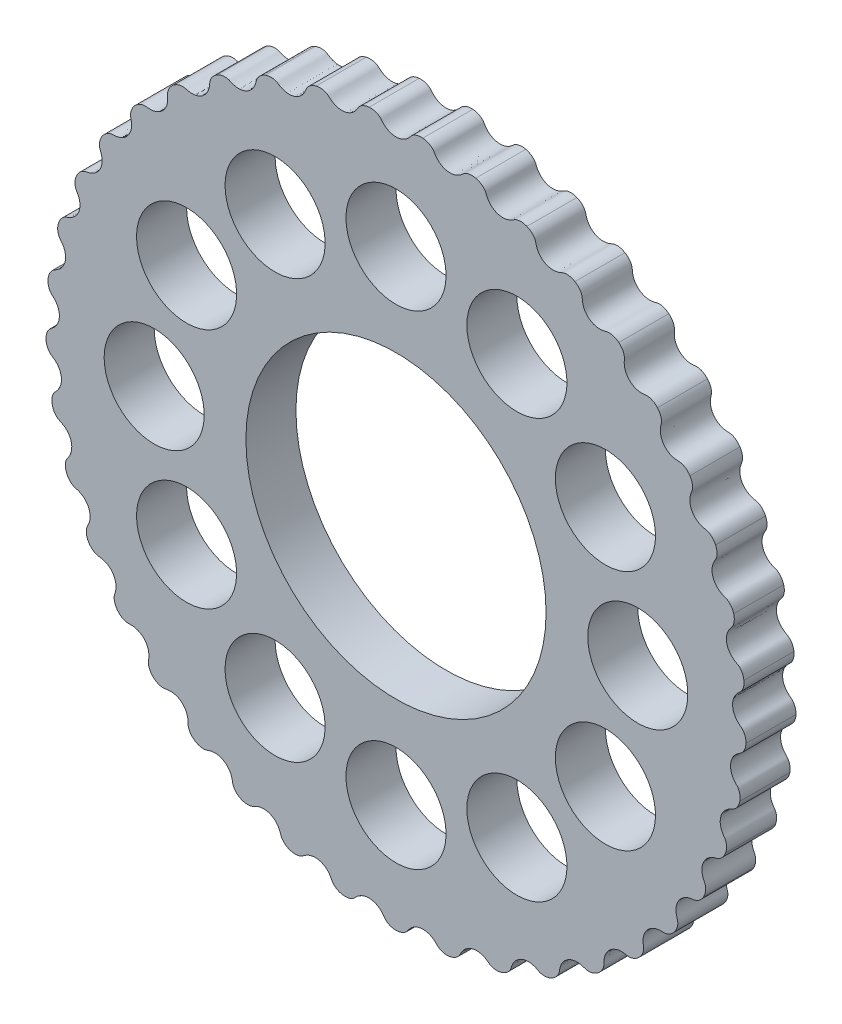
from build123d import *

# Parameters (mm, degrees)
BOSS_EXTRUDE1_DEPTH = 15
SKETCH4_R           = 45
SKETCH4_R_2         = 15
CUT_EXTRUDE1_DEPTH  = 59


with BuildPart() as part:
    # Sketch1 → Boss-Extrude1 (new body)
    with BuildSketch(Plane.XY):
        with BuildLine():
            add(Edge.make_bspline(
                [(-8.037675922, 104.6919661), (-8.018237397, 104.693458483), (-7.997836722, 104.694950481), (-7.808910501, 104.705522343), (-7.804956383, 104.705054172), (-7.637937828, 104.707274645), (-7.577844344, 104.706883104), (-7.520737063, 104.705808887), (-7.346990898, 104.699603962), (-7.138810685, 104.684484115), (-6.736040264, 104.632149986), (-6.259993911, 104.523559952), (-5.818787733, 104.363449551), (-5.496616064, 104.209711342), (-5.271785385, 104.083192618), (-5.065918929, 103.947695634), (-4.912183853, 103.829831086), (-4.796878485, 103.73097558), (-4.714077984, 103.654432348), (-4.634378134, 103.575126935), (-4.563329113, 103.499173627), (-4.50141658, 103.429527162), (-4.447066828, 103.366561455), (-4.375482534, 103.281788434), (-4.294977714, 103.18551253), (-4.211829681, 103.086938885), (-4.142270364, 103.005325697), (-4.042930822, 102.890895384), (-3.872685296, 102.702610196), (-3.574294592, 102.404729867), (-3.182705778, 102.073132784), (-2.685144425, 101.737807353), (-2.056281812, 101.398942902), (-1.099176571, 101.079935798), (0.002712908, 100.958755267), (1.118972816, 101.085505542), (2.026656318, 101.388892802), (2.662240048, 101.722192446), (3.205019144, 102.087515169), (3.598860669, 102.429003896), (3.867255922, 102.698518077), (4.017817793, 102.862807502), (4.170106693, 103.03598921), (4.288391909, 103.177400646), (4.381418914, 103.289000881), (4.444253666, 103.363503332), (4.499087152, 103.426947735), (4.563130653, 103.498928904), (4.634800393, 103.575511283), (4.714468796, 103.654810829), (4.796801714, 103.730918559), (4.91195834, 103.829655851), (5.066150305, 103.947846998), (5.271688121, 104.083145484), (5.496621246, 104.209697597), (5.818698248, 104.363450026), (6.261519065, 104.52397837), (6.735456014, 104.63205421), (7.139047433, 104.684454331), (7.344878478, 104.699527035), (7.52145939, 104.705815503), (7.578665097, 104.706911733), (7.637216603, 104.707253493), (7.760835989, 104.705736916), (7.81519834, 104.704719357), (7.852484495, 104.703122993), (7.999066651, 104.694865043), (8.018276642, 104.69345547), (8.037675922, 104.6919661)],
                knots=[0.082706155, 0.082706155, 0.082706155, 0.082706155, 0.089226372, 0.095746588, 0.108787021, 0.115307237, 0.121827453, 0.12834767, 0.134867886, 0.160948751, 0.187029617, 0.239191347, 0.291353078, 0.317433943, 0.343514808, 0.369595674, 0.395676539, 0.408716972, 0.421757404, 0.434797837, 0.447838269, 0.454358486, 0.460878702, 0.467398918, 0.473919135, 0.477179243, 0.480439351, 0.483699459, 0.486959567, 0.490219676, 0.493479784, 0.495109838, 0.496739892, 0.498369946, 0.5, 0.501630054, 0.503260108, 0.504890162, 0.506520216, 0.509780324, 0.513040433, 0.516300541, 0.519560649, 0.526080865, 0.532601082, 0.539121298, 0.545641514, 0.552161731, 0.565202163, 0.578242596, 0.591283028, 0.604323461, 0.630404326, 0.656485192, 0.682566057, 0.708646922, 0.760808653, 0.812970383, 0.839051249, 0.865132114, 0.87165233, 0.878172547, 0.884692763, 0.891212979, 0.897733196, 0.904253412, 0.910773628, 0.917293845, 0.917293845, 0.917293845, 0.917293845], degree=3))
            add(Edge.make_bspline(
                [(8.037675922, 104.6919661), (8.057114447, 104.690473716), (8.077503787, 104.68883408), (8.265829661, 104.670442592), (8.269665972, 104.669376314), (8.435066094, 104.646075501), (8.494395539, 104.636515321), (8.550669568, 104.626736309), (8.721432325, 104.594081875), (8.92486472, 104.547360666), (9.314926075, 104.434157254), (9.768817175, 104.254171714), (10.180411865, 104.028587932), (10.475339792, 103.827472195), (10.678222558, 103.668115974), (10.860992829, 103.502781591), (10.994934256, 103.362830816), (11.093798072, 103.247532573), (11.163943917, 103.159246957), (11.230603803, 103.068704845), (11.289225942, 102.982796095), (11.339781403, 102.904514954), (11.383882529, 102.833990728), (11.441687345, 102.739283919), (11.506552234, 102.631847325), (11.573678611, 102.521736433), (11.629964528, 102.430461537), (11.710672147, 102.302208189), (11.850180869, 102.090141766), (12.099603341, 101.750203341), (12.435984842, 101.362716684), (12.8765278, 100.95536874), (13.446292994, 100.524480209), (14.343485161, 100.063110303), (15.413962841, 99.775147316), (16.536488995, 99.730015856), (17.479846678, 99.891290309), (18.158859589, 100.123662421), (18.751043796, 100.401848875), (19.192397675, 100.679215873), (19.498788596, 100.904601118), (19.672664609, 101.043981979), (19.849604811, 101.191887279), (19.988090129, 101.31358528), (20.097062594, 101.409677102), (20.170533695, 101.473714735), (20.234409298, 101.528045305), (20.30869011, 101.58940669), (20.391210156, 101.654151221), (20.482049898, 101.720360086), (20.5750357, 101.783007804), (20.703914916, 101.863009361), (20.87434161, 101.956278065), (21.098123827, 102.058615709), (21.339738921, 102.149348804), (21.681511515, 102.252134497), (22.143647197, 102.343185236), (22.628527505, 102.377648336), (23.035387845, 102.367826409), (23.241107475, 102.351302505), (23.416578864, 102.330562325), (23.473281483, 102.322913298), (23.53119896, 102.314313207), (23.653138073, 102.293943993), (23.706707991, 102.284639985), (23.743313484, 102.277370625), (23.88691719, 102.246833794), (23.905686878, 102.242508349), (23.924631455, 102.238075147)],
                knots=[0.082706155, 0.082706155, 0.082706155, 0.082706155, 0.089226372, 0.095746588, 0.108787021, 0.115307237, 0.121827453, 0.12834767, 0.134867886, 0.160948751, 0.187029617, 0.239191347, 0.291353078, 0.317433943, 0.343514808, 0.369595674, 0.395676539, 0.408716972, 0.421757404, 0.434797837, 0.447838269, 0.454358486, 0.460878702, 0.467398918, 0.473919135, 0.477179243, 0.480439351, 0.483699459, 0.486959567, 0.490219676, 0.493479784, 0.495109838, 0.496739892, 0.498369946, 0.5, 0.501630054, 0.503260108, 0.504890162, 0.506520216, 0.509780324, 0.513040433, 0.516300541, 0.519560649, 0.526080865, 0.532601082, 0.539121298, 0.545641514, 0.552161731, 0.565202163, 0.578242596, 0.591283028, 0.604323461, 0.630404326, 0.656485192, 0.682566057, 0.708646922, 0.760808653, 0.812970383, 0.839051249, 0.865132114, 0.87165233, 0.878172547, 0.884692763, 0.891212979, 0.897733196, 0.904253412, 0.910773628, 0.917293845, 0.917293845, 0.917293845, 0.917293845], degree=3))
            add(Edge.make_bspline(
                [(23.924631455, 102.238075147), (23.943614358, 102.233632977), (23.963514454, 102.228900139), (24.14682578, 102.181976381), (24.150454365, 102.180336989), (24.310359215, 102.132061042), (24.36753399, 102.113556306), (24.421655752, 102.095301709), (24.585432566, 102.036963159), (24.77934886, 101.959735693), (25.147558442, 101.788316391), (25.568655467, 101.541154053), (25.940991239, 101.255384383), (26.201762562, 101.0116051), (26.377942015, 100.823146557), (26.53333212, 100.631850072), (26.644340425, 100.473093398), (26.724445405, 100.34405491), (26.780292434, 100.246096252), (26.832349906, 100.146439671), (26.877171109, 100.052589108), (26.915184522, 99.967508133), (26.948003328, 99.891078416), (26.990673769, 99.788657667), (27.03837835, 99.672578605), (27.087909686, 99.553511373), (27.129602908, 99.454714175), (27.189786886, 99.315643942), (27.295288837, 99.084766941), (27.489896826, 98.710738288), (27.763186518, 98.276444415), (28.136385127, 97.806621849), (28.633698089, 97.2938089), (29.449947758, 96.700890312), (30.46392255, 96.252894478), (31.566403887, 96.036939125), (32.523324248, 96.052320635), (33.229850852, 96.178318609), (33.857559874, 96.362848341), (34.336081146, 96.569592361), (34.673286192, 96.745565832), (34.86640084, 96.85677116), (35.063845017, 96.975933277), (35.219284458, 97.075065344), (35.341648159, 97.153396442), (35.424033509, 97.20546827), (35.49545404, 97.249411544), (35.578231084, 97.298714886), (35.669667236, 97.350104013), (35.769549111, 97.401670316), (35.871008288, 97.449389614), (36.010589275, 97.508780266), (36.193256041, 97.574940388), (36.430037393, 97.641918482), (36.682671203, 97.694705853), (37.036128529, 97.744115599), (37.506747007, 97.763554581), (37.991205491, 97.723597157), (38.39179829, 97.651783398), (38.592584611, 97.604050194), (38.762833575, 97.556767498), (38.817704046, 97.5405525), (38.873629956, 97.523212137), (38.991030649, 97.484467723), (39.042552501, 97.467095345), (39.07761933, 97.454323376), (39.214878635, 97.402223421), (39.232768075, 97.395083489), (39.250813904, 97.387810366)],
                knots=[0.082706155, 0.082706155, 0.082706155, 0.082706155, 0.089226372, 0.095746588, 0.108787021, 0.115307237, 0.121827453, 0.12834767, 0.134867886, 0.160948751, 0.187029617, 0.239191347, 0.291353078, 0.317433943, 0.343514808, 0.369595674, 0.395676539, 0.408716972, 0.421757404, 0.434797837, 0.447838269, 0.454358486, 0.460878702, 0.467398918, 0.473919135, 0.477179243, 0.480439351, 0.483699459, 0.486959567, 0.490219676, 0.493479784, 0.495109838, 0.496739892, 0.498369946, 0.5, 0.501630054, 0.503260108, 0.504890162, 0.506520216, 0.509780324, 0.513040433, 0.516300541, 0.519560649, 0.526080865, 0.532601082, 0.539121298, 0.545641514, 0.552161731, 0.565202163, 0.578242596, 0.591283028, 0.604323461, 0.630404326, 0.656485192, 0.682566057, 0.708646922, 0.760808653, 0.812970383, 0.839051249, 0.865132114, 0.87165233, 0.878172547, 0.884692763, 0.891212979, 0.897733196, 0.904253412, 0.910773628, 0.917293845, 0.917293845, 0.917293845, 0.917293845], degree=3))
            add(Edge.make_bspline(
                [(39.250813904, 97.387810366), (39.268896241, 97.380522529), (39.287840653, 97.372807423), (39.46184077, 97.298451249), (39.465176577, 97.296277169), (39.615838122, 97.224157635), (39.669518097, 97.197142078), (39.720219024, 97.170839769), (39.873171105, 97.088184509), (40.053026065, 96.982260932), (40.390753353, 96.756643662), (40.769186145, 96.448097803), (41.093535764, 96.108840443), (41.314038225, 95.828111595), (41.459384868, 95.614968039), (41.583752595, 95.402193279), (41.669225837, 95.228351827), (41.728694387, 95.088597648), (41.768933594, 94.983262015), (41.805168469, 94.876826831), (41.835138165, 94.777234232), (41.859718527, 94.68734765), (41.880485769, 94.606803889), (41.907021677, 94.499069856), (41.936447794, 94.377069122), (41.967223116, 94.251836384), (41.99334639, 94.147832607), (42.031596066, 94.001205177), (42.10061837, 93.756929159), (42.23585043, 93.357577193), (42.439642633, 92.886655584), (42.736749434, 92.365370639), (43.149953569, 91.782653173), (43.86612854, 91.072083412), (44.799833734, 90.474555373), (45.856429027, 90.092837939), (46.804482663, 89.961965975), (47.521962575, 89.978636527), (48.170483445, 90.065184315), (48.674955978, 90.196459453), (49.035071348, 90.31889648), (49.242898187, 90.399319716), (49.456218414, 90.486945592), (49.624968609, 90.561188154), (49.757855446, 90.619922512), (49.847224002, 90.658808017), (49.924515423, 90.691334001), (50.013848476, 90.727423672), (50.112057549, 90.764252877), (50.218640409, 90.799967948), (50.326194845, 90.831640325), (50.473205942, 90.869028007), (50.663831226, 90.906528808), (50.908061759, 90.936577444), (51.165792762, 90.950181799), (51.522650081, 90.945057476), (51.990720456, 90.892429068), (52.46340182, 90.778987687), (52.848337522, 90.646865351), (53.039484273, 90.569041672), (53.200520322, 90.496324726), (53.252272526, 90.471923823), (53.304896014, 90.446249631), (53.415006514, 90.390038154), (53.46327267, 90.365004599), (53.495978899, 90.347029386), (53.623676563, 90.274587485), (53.64026644, 90.26480042), (53.656990543, 90.254857852)],
                knots=[0.082706155, 0.082706155, 0.082706155, 0.082706155, 0.089226372, 0.095746588, 0.108787021, 0.115307237, 0.121827453, 0.12834767, 0.134867886, 0.160948751, 0.187029617, 0.239191347, 0.291353078, 0.317433943, 0.343514808, 0.369595674, 0.395676539, 0.408716972, 0.421757404, 0.434797837, 0.447838269, 0.454358486, 0.460878702, 0.467398918, 0.473919135, 0.477179243, 0.480439351, 0.483699459, 0.486959567, 0.490219676, 0.493479784, 0.495109838, 0.496739892, 0.498369946, 0.5, 0.501630054, 0.503260108, 0.504890162, 0.506520216, 0.509780324, 0.513040433, 0.516300541, 0.519560649, 0.526080865, 0.532601082, 0.539121298, 0.545641514, 0.552161731, 0.565202163, 0.578242596, 0.591283028, 0.604323461, 0.630404326, 0.656485192, 0.682566057, 0.708646922, 0.760808653, 0.812970383, 0.839051249, 0.865132114, 0.87165233, 0.878172547, 0.884692763, 0.891212979, 0.897733196, 0.904253412, 0.910773628, 0.917293845, 0.917293845, 0.917293845, 0.917293845], degree=3))
            add(Edge.make_bspline(
                [(53.656990543, 90.254857852), (53.673748479, 90.24489517), (53.691293165, 90.23437863), (53.851903658, 90.134332886), (53.854868499, 90.131675077), (53.992755359, 90.037402376), (54.041682322, 90.00250922), (54.087774027, 89.968775703), (54.226316309, 89.863741101), (54.387894286, 89.731604173), (54.687223239, 89.457077214), (55.014121655, 89.094379886), (55.28288264, 88.709586742), (55.457947848, 88.398488374), (55.569054878, 88.165655709), (55.659485154, 87.936389934), (55.717419913, 87.751538402), (55.754858141, 87.604344251), (55.778546352, 87.494100621), (55.798109315, 87.383381584), (55.812525041, 87.280381315), (55.823096208, 87.187795992), (55.83132512, 87.105026065), (55.841104515, 86.994503941), (55.851562446, 86.869441128), (55.862860407, 86.740978235), (55.872801425, 86.634205639), (55.888220258, 86.483457834), (55.91914509, 86.231508422), (55.991831496, 85.816193615), (56.121349495, 85.319682274), (56.335400557, 84.759153427), (56.65481071, 84.120189847), (57.254124448, 83.308624066), (58.085674785, 82.575569373), (59.071618336, 82.03703699), (59.988583674, 81.762979081), (60.700199774, 81.669931466), (61.354331711, 81.656468704), (61.872931096, 81.709197983), (62.247515991, 81.775228746), (62.465183737, 81.822984837), (62.689379968, 81.877020595), (62.867485557, 81.924633469), (63.007780774, 81.962394405), (63.102037813, 81.987182142), (63.18338848, 82.007528455), (63.277183649, 82.029558544), (63.379863705, 82.050964582), (63.49064934, 82.06999129), (63.601778048, 82.084874373), (63.752773441, 82.099382748), (63.946889148, 82.107345243), (64.192844306, 82.099760105), (64.449631505, 82.07386257), (64.801524383, 82.014324287), (65.256075483, 81.890862054), (65.705900476, 81.706595686), (66.066156515, 81.517261609), (66.243183378, 81.411171575), (66.391231963, 81.314724803), (66.438652873, 81.282709932), (66.486740489, 81.249303693), (66.586979899, 81.176942701), (66.630859041, 81.144834735), (66.660438064, 81.122077601), (66.775580961, 81.030991732), (66.790482423, 81.018786934), (66.805492801, 81.006407966)],
                knots=[0.082706155, 0.082706155, 0.082706155, 0.082706155, 0.089226372, 0.095746588, 0.108787021, 0.115307237, 0.121827453, 0.12834767, 0.134867886, 0.160948751, 0.187029617, 0.239191347, 0.291353078, 0.317433943, 0.343514808, 0.369595674, 0.395676539, 0.408716972, 0.421757404, 0.434797837, 0.447838269, 0.454358486, 0.460878702, 0.467398918, 0.473919135, 0.477179243, 0.480439351, 0.483699459, 0.486959567, 0.490219676, 0.493479784, 0.495109838, 0.496739892, 0.498369946, 0.5, 0.501630054, 0.503260108, 0.504890162, 0.506520216, 0.509780324, 0.513040433, 0.516300541, 0.519560649, 0.526080865, 0.532601082, 0.539121298, 0.545641514, 0.552161731, 0.565202163, 0.578242596, 0.591283028, 0.604323461, 0.630404326, 0.656485192, 0.682566057, 0.708646922, 0.760808653, 0.812970383, 0.839051249, 0.865132114, 0.87165233, 0.878172547, 0.884692763, 0.891212979, 0.897733196, 0.904253412, 0.910773628, 0.917293845, 0.917293845, 0.917293845, 0.917293845], degree=3))
            add(Edge.make_bspline(
                [(66.805492801, 81.006407966), (66.820533545, 80.994003956), (66.836267272, 80.980932482), (66.979723567, 80.857542154), (66.982247949, 80.854462913), (67.104128173, 80.740246718), (67.147155318, 80.698293829), (67.18755745, 80.657919788), (67.308442618, 80.532967768), (67.447956363, 80.377714666), (67.701870963, 80.060712696), (67.96957278, 79.652365218), (68.176445603, 79.231055514), (68.301970177, 78.896879508), (68.376233341, 78.649815135), (68.430606555, 78.409432141), (68.459644889, 78.217903291), (68.474175276, 78.066719274), (68.48075726, 77.954151664), (68.483189772, 77.841743936), (68.481713634, 77.737750236), (68.478027828, 77.644636292), (68.473525531, 77.561580256), (68.466319192, 77.450860588), (68.457563812, 77.325667062), (68.449119596, 77.196985073), (68.442645349, 77.089946318), (68.434871936, 76.938611539), (68.426974445, 76.684894215), (68.435411489, 76.263351193), (68.487619491, 75.752887925), (68.613597638, 75.166253497), (68.831727106, 74.486020568), (69.300132206, 73.59248118), (70.010036851, 72.741082014), (70.902218979, 72.058357425), (71.766603128, 71.647537257), (72.455675736, 71.446952432), (73.100086444, 71.333794676), (73.62065715, 71.306742165), (74.000931618, 71.31481896), (74.223338324, 71.328788544), (74.453155589, 71.347967631), (74.636441927, 71.367834812), (74.780857124, 71.383737242), (74.87779334, 71.393846207), (74.961296462, 71.401535949), (75.057355269, 71.408990089), (75.162099575, 71.41447122), (75.274491262, 71.416363596), (75.386589481, 71.414108537), (75.538029964, 71.405397541), (75.731086187, 71.383635096), (75.973000989, 71.338593974), (76.222825511, 71.273801564), (76.561505877, 71.16124485), (76.991883409, 70.969842641), (77.408308514, 70.719070334), (77.735440794, 70.476962345), (77.894198409, 70.345092618), (78.025789397, 70.227176651), (78.067767507, 70.188298212), (78.110192118, 70.14794294), (78.198210911, 70.061128514), (78.236674551, 70.02269872), (78.26243306, 69.995693073), (78.362322337, 69.888098211), (78.375186107, 69.873761751), (78.38813093, 69.859236536)],
                knots=[0.082706155, 0.082706155, 0.082706155, 0.082706155, 0.089226372, 0.095746588, 0.108787021, 0.115307237, 0.121827453, 0.12834767, 0.134867886, 0.160948751, 0.187029617, 0.239191347, 0.291353078, 0.317433943, 0.343514808, 0.369595674, 0.395676539, 0.408716972, 0.421757404, 0.434797837, 0.447838269, 0.454358486, 0.460878702, 0.467398918, 0.473919135, 0.477179243, 0.480439351, 0.483699459, 0.486959567, 0.490219676, 0.493479784, 0.495109838, 0.496739892, 0.498369946, 0.5, 0.501630054, 0.503260108, 0.504890162, 0.506520216, 0.509780324, 0.513040433, 0.516300541, 0.519560649, 0.526080865, 0.532601082, 0.539121298, 0.545641514, 0.552161731, 0.565202163, 0.578242596, 0.591283028, 0.604323461, 0.630404326, 0.656485192, 0.682566057, 0.708646922, 0.760808653, 0.812970383, 0.839051249, 0.865132114, 0.87165233, 0.878172547, 0.884692763, 0.891212979, 0.897733196, 0.904253412, 0.910773628, 0.917293845, 0.917293845, 0.917293845, 0.917293845], degree=3))
            add(Edge.make_bspline(
                [(78.38813093, 69.859236536), (78.401101939, 69.844681937), (78.414655923, 69.829361912), (78.537595525, 69.685519166), (78.539620278, 69.682090667), (78.642637097, 69.550608109), (78.678755904, 69.502578827), (78.712521472, 69.456510596), (78.81291608, 69.314569926), (78.927095508, 69.139839652), (79.129644213, 68.787792928), (79.331874729, 68.343366619), (79.472010465, 67.895415498), (79.545052216, 67.545994657), (79.580730847, 67.290489555), (79.597772538, 67.044623716), (79.597233814, 66.850906821), (79.588515778, 66.699276564), (79.577837259, 66.587023464), (79.563082304, 66.475561785), (79.545748901, 66.373012179), (79.527892515, 66.281552126), (79.510764538, 66.200156744), (79.486741376, 66.091834706), (79.458977904, 65.969444898), (79.430989437, 65.843560011), (79.408251676, 65.738763993), (79.377468219, 65.590389401), (79.330933515, 65.340851082), (79.27492344, 64.922960457), (79.248597734, 64.410510088), (79.283550144, 63.811520293), (79.395286158, 63.105962099), (79.7218036, 62.151392911), (80.293422991, 61.201605346), (81.070931702, 60.390691037), (81.862474231, 59.852737885), (82.51285207, 59.549317388), (83.132437107, 59.33911696), (83.642777398, 59.232916747), (84.019828128, 59.18285026), (84.241760768, 59.162705903), (84.471812347, 59.146578778), (84.655983358, 59.138234595), (84.801133564, 59.131905779), (84.898476855, 59.127099028), (84.982175189, 59.121951957), (85.078246097, 59.11465543), (85.182599535, 59.104083181), (85.293962909, 59.088796868), (85.404403151, 59.069456525), (85.552739089, 59.037730337), (85.740210752, 58.986753044), (85.97241492, 58.905311664), (86.20942109, 58.803143059), (86.526950564, 58.640206146), (86.923066844, 58.385350268), (87.29633141, 58.073949911), (87.582672226, 57.784742817), (87.71943945, 57.630184311), (87.83148846, 57.493562999), (87.867039838, 57.448732271), (87.902807048, 57.402373859), (87.976542137, 57.303140856), (88.008688719, 57.259289995), (88.030022956, 57.228668825), (88.112317295, 57.107086903), (88.122841857, 57.090954814), (88.133417708, 57.074623811)],
                knots=[0.082706155, 0.082706155, 0.082706155, 0.082706155, 0.089226372, 0.095746588, 0.108787021, 0.115307237, 0.121827453, 0.12834767, 0.134867886, 0.160948751, 0.187029617, 0.239191347, 0.291353078, 0.317433943, 0.343514808, 0.369595674, 0.395676539, 0.408716972, 0.421757404, 0.434797837, 0.447838269, 0.454358486, 0.460878702, 0.467398918, 0.473919135, 0.477179243, 0.480439351, 0.483699459, 0.486959567, 0.490219676, 0.493479784, 0.495109838, 0.496739892, 0.498369946, 0.5, 0.501630054, 0.503260108, 0.504890162, 0.506520216, 0.509780324, 0.513040433, 0.516300541, 0.519560649, 0.526080865, 0.532601082, 0.539121298, 0.545641514, 0.552161731, 0.565202163, 0.578242596, 0.591283028, 0.604323461, 0.630404326, 0.656485192, 0.682566057, 0.708646922, 0.760808653, 0.812970383, 0.839051249, 0.865132114, 0.87165233, 0.878172547, 0.884692763, 0.891212979, 0.897733196, 0.904253412, 0.910773628, 0.917293845, 0.917293845, 0.917293845, 0.917293845], degree=3))
            add(Edge.make_bspline(
                [(88.133417708, 57.074623811), (88.144014954, 57.05825977), (88.155071499, 57.041050284), (88.254612809, 56.880126672), (88.256090475, 56.876429276), (88.337829262, 56.730762194), (88.366193136, 56.677782285), (88.392530704, 56.627099665), (88.470081588, 56.471497314), (88.55625043, 56.281385396), (88.70268567, 55.902545597), (88.834704771, 55.432457432), (88.904818758, 54.968364488), (88.92366565, 54.61188894), (88.919923471, 54.353931932), (88.899234197, 54.108346135), (88.869131041, 53.916981756), (88.837368927, 53.768459343), (88.8096802, 53.65915187), (88.778083621, 53.551248808), (88.745299235, 53.452546971), (88.713690806, 53.364884556), (88.684338615, 53.287057667), (88.644061713, 53.183672236), (88.5979409, 53.066954858), (88.551064209, 52.946817709), (88.512595887, 52.846720759), (88.459523924, 52.704784126), (88.375442741, 52.46527378), (88.256298376, 52.060830554), (88.152056013, 51.558404486), (88.095163433, 50.961099138), (88.097886995, 50.246753363), (88.274863488, 49.253528668), (88.694799349, 48.22761492), (89.339410499, 47.307518035), (90.039558321, 46.655041065), (90.635997086, 46.255896817), (91.216233904, 45.953580637), (91.704381837, 45.770721965), (92.069371078, 45.663685712), (92.285627741, 45.609899579), (92.510521418, 45.558844248), (92.691260289, 45.522484283), (92.833743307, 45.494072563), (92.929212029, 45.474462761), (93.011143758, 45.456599521), (93.104974945, 45.434723351), (93.206491559, 45.408345527), (93.314216357, 45.376238823), (93.420409997, 45.340266517), (93.56216452, 45.286268772), (93.739657448, 45.207271495), (93.956708313, 45.091338774), (94.175340907, 44.95418872), (94.464276867, 44.744690711), (94.816847264, 44.432354769), (95.138202286, 44.067625324), (95.377040054, 43.738097894), (95.488611178, 43.564473329), (95.578491875, 43.41234896), (95.606783228, 43.362616737), (95.635054682, 43.311341787), (95.692777781, 43.202016143), (95.717853816, 43.153772044), (95.734263726, 43.120253085), (95.797034216, 42.987533879), (95.804972883, 42.969984285), (95.812931873, 42.952230278)],
                knots=[0.082706155, 0.082706155, 0.082706155, 0.082706155, 0.089226372, 0.095746588, 0.108787021, 0.115307237, 0.121827453, 0.12834767, 0.134867886, 0.160948751, 0.187029617, 0.239191347, 0.291353078, 0.317433943, 0.343514808, 0.369595674, 0.395676539, 0.408716972, 0.421757404, 0.434797837, 0.447838269, 0.454358486, 0.460878702, 0.467398918, 0.473919135, 0.477179243, 0.480439351, 0.483699459, 0.486959567, 0.490219676, 0.493479784, 0.495109838, 0.496739892, 0.498369946, 0.5, 0.501630054, 0.503260108, 0.504890162, 0.506520216, 0.509780324, 0.513040433, 0.516300541, 0.519560649, 0.526080865, 0.532601082, 0.539121298, 0.545641514, 0.552161731, 0.565202163, 0.578242596, 0.591283028, 0.604323461, 0.630404326, 0.656485192, 0.682566057, 0.708646922, 0.760808653, 0.812970383, 0.839051249, 0.865132114, 0.87165233, 0.878172547, 0.884692763, 0.891212979, 0.897733196, 0.904253412, 0.910773628, 0.917293845, 0.917293845, 0.917293845, 0.917293845], degree=3))
            add(Edge.make_bspline(
                [(95.812931873, 42.952230278), (95.820906965, 42.934440355), (95.829206916, 42.915744783), (95.903016771, 42.741512218), (95.903912714, 42.737632589), (95.962457581, 42.581195296), (95.982401698, 42.524506564), (96.000693934, 42.470397512), (96.053583368, 42.304780668), (96.109721899, 42.103743169), (96.196611355, 41.706989977), (96.255324627, 41.222258425), (96.253773452, 40.752901604), (96.217983729, 40.397726834), (96.174908455, 40.143364213), (96.116973154, 39.90381478), (96.058011158, 39.719288336), (96.003949443, 39.577355007), (95.959899509, 39.473555235), (95.912201903, 39.371739947), (95.864734971, 39.279199367), (95.820115375, 39.197389322), (95.77922696, 39.124955122), (95.723640374, 39.028929564), (95.660243253, 38.920620374), (95.595577087, 38.809046875), (95.542279871, 38.71599518), (95.468163362, 38.583823382), (95.348506493, 38.359954928), (95.16902048, 37.978438908), (94.989304814, 37.497813582), (94.841900757, 36.916193011), (94.735548029, 36.209803317), (94.758835393, 35.201203459), (95.017244785, 34.123210077), (95.513849235, 33.115496906), (96.106191479, 32.363789626), (96.63471115, 31.878277229), (97.16199949, 31.490931331), (97.616513291, 31.235700253), (97.960886005, 31.074203073), (98.166397816, 30.988035866), (98.380862276, 30.903249023), (98.553932641, 30.839725522), (98.69040879, 30.789896845), (98.781765236, 30.755943629), (98.860009949, 30.725782919), (98.949402093, 30.689839865), (99.045702419, 30.648274739), (99.147263663, 30.6001002), (99.246721611, 30.54833909), (99.378572115, 30.473335449), (99.541926023, 30.368169819), (99.738736097, 30.220463121), (99.933870552, 30.051546298), (100.187440583, 29.80039765), (100.488201147, 29.437902534), (100.750114336, 29.02839295), (100.9358509, 28.666269027), (101.019610793, 28.477648016), (101.08521645, 28.313586256), (101.105584651, 28.260118219), (101.125697692, 28.205128572), (101.166055819, 28.088272789), (101.183473546, 28.036766251), (101.194574494, 28.00113516), (101.236349849, 27.860389496), (101.241516545, 27.841833744), (101.246672123, 27.823072872)],
                knots=[0.082706155, 0.082706155, 0.082706155, 0.082706155, 0.089226372, 0.095746588, 0.108787021, 0.115307237, 0.121827453, 0.12834767, 0.134867886, 0.160948751, 0.187029617, 0.239191347, 0.291353078, 0.317433943, 0.343514808, 0.369595674, 0.395676539, 0.408716972, 0.421757404, 0.434797837, 0.447838269, 0.454358486, 0.460878702, 0.467398918, 0.473919135, 0.477179243, 0.480439351, 0.483699459, 0.486959567, 0.490219676, 0.493479784, 0.495109838, 0.496739892, 0.498369946, 0.5, 0.501630054, 0.503260108, 0.504890162, 0.506520216, 0.509780324, 0.513040433, 0.516300541, 0.519560649, 0.526080865, 0.532601082, 0.539121298, 0.545641514, 0.552161731, 0.565202163, 0.578242596, 0.591283028, 0.604323461, 0.630404326, 0.656485192, 0.682566057, 0.708646922, 0.760808653, 0.812970383, 0.839051249, 0.865132114, 0.87165233, 0.878172547, 0.884692763, 0.891212979, 0.897733196, 0.904253412, 0.910773628, 0.917293845, 0.917293845, 0.917293845, 0.917293845], degree=3))
            add(Edge.make_bspline(
                [(101.246672123, 27.823072872), (101.251838131, 27.804274047), (101.257186945, 27.784530598), (101.303535302, 27.601072943), (101.303828523, 27.597102017), (101.337807228, 27.433561271), (101.348864114, 27.374492452), (101.358682265, 27.318225238), (101.385670564, 27.146475819), (101.410462946, 26.939224888), (101.435770004, 26.533857861), (101.419801256, 26.045844619), (101.346621278, 25.582225247), (101.25703382, 25.23667625), (101.175635098, 24.991870061), (101.081811725, 24.763971828), (100.995372909, 24.590608463), (100.920278753, 24.458591014), (100.860900104, 24.362731922), (100.798219464, 24.269390872), (100.737182571, 24.185180621), (100.680597653, 24.111140505), (100.629131404, 24.04579679), (100.559538037, 23.959381864), (100.480350583, 23.862019537), (100.399410662, 23.761624875), (100.332533792, 23.677799489), (100.239109967, 23.55849052), (100.086682066, 23.355511245), (99.851061406, 23.005864842), (99.600084819, 22.558305709), (99.365624311, 22.006002609), (99.152688111, 21.32412617), (99.021740511, 20.323791876), (99.112566536, 19.218986111), (99.449524298, 18.147276597), (99.920176963, 17.313958389), (100.368389489, 16.753457841), (100.830370159, 16.290161286), (101.240596409, 15.968540201), (101.556280792, 15.756367452), (101.746230729, 15.639838857), (101.945239105, 15.523307834), (102.106584342, 15.434109734), (102.233854736, 15.364032041), (102.31895759, 15.316531246), (102.391681297, 15.274780008), (102.474539122, 15.225612544), (102.563365962, 15.169834368), (102.656383142, 15.106721163), (102.746774189, 15.040384487), (102.865630208, 14.946132972), (103.01101622, 14.817263981), (103.182972441, 14.641245426), (103.350034971, 14.444521102), (103.562295608, 14.157608525), (103.804196765, 13.753450814), (104.000529097, 13.308759648), (104.12881095, 12.922527111), (104.18279635, 12.72333077), (104.222589227, 12.551177088), (104.234556864, 12.495226482), (104.246040058, 12.437811049), (104.268087254, 12.316164127), (104.277438416, 12.262602421), (104.282970204, 12.225694359), (104.302771246, 12.080221196), (104.305044868, 12.061094218), (104.307276191, 12.04176622)],
                knots=[0.082706155, 0.082706155, 0.082706155, 0.082706155, 0.089226372, 0.095746588, 0.108787021, 0.115307237, 0.121827453, 0.12834767, 0.134867886, 0.160948751, 0.187029617, 0.239191347, 0.291353078, 0.317433943, 0.343514808, 0.369595674, 0.395676539, 0.408716972, 0.421757404, 0.434797837, 0.447838269, 0.454358486, 0.460878702, 0.467398918, 0.473919135, 0.477179243, 0.480439351, 0.483699459, 0.486959567, 0.490219676, 0.493479784, 0.495109838, 0.496739892, 0.498369946, 0.5, 0.501630054, 0.503260108, 0.504890162, 0.506520216, 0.509780324, 0.513040433, 0.516300541, 0.519560649, 0.526080865, 0.532601082, 0.539121298, 0.545641514, 0.552161731, 0.565202163, 0.578242596, 0.591283028, 0.604323461, 0.630404326, 0.656485192, 0.682566057, 0.708646922, 0.760808653, 0.812970383, 0.839051249, 0.865132114, 0.87165233, 0.878172547, 0.884692763, 0.891212979, 0.897733196, 0.904253412, 0.910773628, 0.917293845, 0.917293845, 0.917293845, 0.917293845], degree=3))
            add(Edge.make_bspline(
                [(104.307276191, 12.04176622), (104.309512028, 12.022399122), (104.311784333, 12.002070565), (104.329584827, 11.813687912), (104.329268453, 11.809718764), (104.337884564, 11.64290782), (104.339795055, 11.582843437), (104.340908991, 11.525736918), (104.341363573, 11.351880585), (104.334228692, 11.143274007), (104.297360176, 10.738794606), (104.207083703, 10.25893829), (104.063990197, 9.811923212), (103.92270486, 9.484099364), (103.804890607, 9.254587657), (103.677378302, 9.043682366), (103.565488719, 8.885545569), (103.471122265, 8.766538377), (103.397806688, 8.680866822), (103.321612193, 8.598187844), (103.248435992, 8.52428174), (103.181212054, 8.459746989), (103.120374297, 8.403025362), (103.038405358, 8.328246559), (102.945283658, 8.244113185), (102.849967145, 8.157250528), (102.771078158, 8.084616246), (102.660536793, 7.980966608), (102.478910641, 7.803634173), (102.192678082, 7.494052803), (101.876323253, 7.09005027), (101.56030185, 6.580010157), (101.245773221, 5.93862958), (100.963659958, 4.970007837), (100.884773732, 3.864285399), (101.054186801, 2.753699506), (101.392118189, 1.858302641), (101.749517846, 1.235951602), (102.13536241, 0.707563667), (102.491685754, 0.327091102), (102.771282432, 0.069215932), (102.94121823, -0.07494272), (103.120105935, -0.220486534), (103.265944248, -0.333268505), (103.381025777, -0.421952652), (103.457880299, -0.481887647), (103.523378418, -0.534250801), (103.597759807, -0.59549023), (103.677031135, -0.664174063), (103.759324007, -0.740746614), (103.838529464, -0.820103981), (103.941605115, -0.931394195), (104.065615505, -1.080945966), (104.208687365, -1.281150653), (104.343762166, -1.501071426), (104.509738199, -1.817022943), (104.687109992, -2.253370136), (104.813259604, -2.7228197), (104.881079927, -3.124107889), (104.904025463, -3.329210565), (104.917072847, -3.505421034), (104.920359408, -3.562542774), (104.9229436, -3.621038223), (104.926163096, -3.744624983), (104.927228511, -3.798986418), (104.92706148, -3.836306356), (104.924424087, -3.98309725), (104.923751344, -4.002347135), (104.923006111, -4.021789226)],
                knots=[0.082706155, 0.082706155, 0.082706155, 0.082706155, 0.089226372, 0.095746588, 0.108787021, 0.115307237, 0.121827453, 0.12834767, 0.134867886, 0.160948751, 0.187029617, 0.239191347, 0.291353078, 0.317433943, 0.343514808, 0.369595674, 0.395676539, 0.408716972, 0.421757404, 0.434797837, 0.447838269, 0.454358486, 0.460878702, 0.467398918, 0.473919135, 0.477179243, 0.480439351, 0.483699459, 0.486959567, 0.490219676, 0.493479784, 0.495109838, 0.496739892, 0.498369946, 0.5, 0.501630054, 0.503260108, 0.504890162, 0.506520216, 0.509780324, 0.513040433, 0.516300541, 0.519560649, 0.526080865, 0.532601082, 0.539121298, 0.545641514, 0.552161731, 0.565202163, 0.578242596, 0.591283028, 0.604323461, 0.630404326, 0.656485192, 0.682566057, 0.708646922, 0.760808653, 0.812970383, 0.839051249, 0.865132114, 0.87165233, 0.878172547, 0.884692763, 0.891212979, 0.897733196, 0.904253412, 0.910773628, 0.917293845, 0.917293845, 0.917293845, 0.917293845], degree=3))
            add(Edge.make_bspline(
                [(104.923006111, -4.021789226), (104.922259372, -4.041270649), (104.921401907, -4.06170783), (104.91023731, -4.25059995), (104.909318756, -4.254474288), (104.892370319, -4.420645521), (104.885089634, -4.48029761), (104.877473246, -4.536904907), (104.851383456, -4.708793109), (104.812488548, -4.913865771), (104.714308624, -5.307976892), (104.55184043, -5.768428857), (104.342187388, -6.188361987), (104.152515779, -6.490776772), (104.001047461, -6.699614438), (103.842835004, -6.888583347), (103.708117251, -7.027786983), (103.59669037, -7.130994488), (103.511156318, -7.204470439), (103.423233903, -7.274549419), (103.339633583, -7.336419081), (103.263346298, -7.389935825), (103.194563018, -7.436705859), (103.102139789, -7.498095786), (102.997266536, -7.567028191), (102.88980757, -7.638322858), (102.800755558, -7.698063549), (102.675687647, -7.783624398), (102.469120407, -7.931153469), (102.138984998, -8.193413481), (101.764667017, -8.544389938), (101.374491992, -9.000212156), (100.96574322, -9.586063455), (100.539076789, -10.500268974), (100.292327337, -11.580990887), (100.290224815, -12.704421967), (100.4875141, -13.640910145), (100.745723743, -14.310524296), (101.046388333, -14.891618645), (101.340456854, -15.322024736), (101.577412317, -15.619557951), (101.723350824, -15.787967702), (101.877924882, -15.959112885), (102.004837944, -16.092835213), (102.105033195, -16.198047133), (102.171837981, -16.269011503), (102.228575292, -16.330759223), (102.292736807, -16.402635218), (102.360594571, -16.482614817), (102.430234261, -16.570851919), (102.496397618, -16.661369907), (102.581276894, -16.787090271), (102.681004964, -16.953819456), (102.791838981, -17.173517646), (102.891760013, -17.411480113), (103.007561104, -17.749064934), (103.116246088, -18.207374), (103.169256141, -18.690578463), (103.175025284, -19.097516447), (103.166393131, -19.303718027), (103.152389203, -19.479855057), (103.146917655, -19.536809046), (103.140542272, -19.595013428), (103.124858607, -19.717643258), (103.117613301, -19.771530234), (103.111751366, -19.808387302), (103.086737357, -19.953055272), (103.083134017, -19.971976863), (103.079429697, -19.991077342)],
                knots=[0.082706155, 0.082706155, 0.082706155, 0.082706155, 0.089226372, 0.095746588, 0.108787021, 0.115307237, 0.121827453, 0.12834767, 0.134867886, 0.160948751, 0.187029617, 0.239191347, 0.291353078, 0.317433943, 0.343514808, 0.369595674, 0.395676539, 0.408716972, 0.421757404, 0.434797837, 0.447838269, 0.454358486, 0.460878702, 0.467398918, 0.473919135, 0.477179243, 0.480439351, 0.483699459, 0.486959567, 0.490219676, 0.493479784, 0.495109838, 0.496739892, 0.498369946, 0.5, 0.501630054, 0.503260108, 0.504890162, 0.506520216, 0.509780324, 0.513040433, 0.516300541, 0.519560649, 0.526080865, 0.532601082, 0.539121298, 0.545641514, 0.552161731, 0.565202163, 0.578242596, 0.591283028, 0.604323461, 0.630404326, 0.656485192, 0.682566057, 0.708646922, 0.760808653, 0.812970383, 0.839051249, 0.865132114, 0.87165233, 0.878172547, 0.884692763, 0.891212979, 0.897733196, 0.904253412, 0.910773628, 0.917293845, 0.917293845, 0.917293845, 0.917293845], degree=3))
            add(Edge.make_bspline(
                [(103.079429697, -19.991077342), (103.075717884, -20.010216461), (103.071750747, -20.030283236), (103.031882748, -20.215257353), (103.030383544, -20.218946068), (102.988267815, -20.380582678), (102.971966608, -20.438424278), (102.955798418, -20.493205526), (102.903775778, -20.659096683), (102.834032507, -20.855828701), (102.676842429, -21.230333911), (102.445990631, -21.660588921), (102.174692142, -22.043597225), (101.941080004, -22.313514602), (101.75950791, -22.496783249), (101.574303667, -22.659386504), (101.419915414, -22.776394164), (101.294039857, -22.861382887), (101.198292176, -22.920941019), (101.100702669, -22.97677741), (101.008637749, -23.025160456), (100.925075226, -23.066404807), (100.849958645, -23.102126998), (100.749247448, -23.148689121), (100.635080784, -23.200804841), (100.517998111, -23.25486043), (100.420870377, -23.30030726), (100.284207407, -23.365773844), (100.057540841, -23.480041596), (99.691240675, -23.688833098), (99.267733237, -23.978556887), (98.812549963, -24.369477125), (98.319161772, -24.886067286), (97.757942872, -25.724428379), (97.349113793, -26.754818562), (97.175544961, -27.864762558), (97.227567849, -28.820391559), (97.380535265, -29.521573633), (97.588972556, -30.141754037), (97.813893537, -30.612005301), (98.00265375, -30.942222634), (98.121174292, -31.130936103), (98.247811617, -31.323671156), (98.352824695, -31.475199504), (98.435785176, -31.594473117), (98.490974378, -31.674803517), (98.537621006, -31.744488491), (98.590058756, -31.825316339), (98.644912427, -31.91471705), (98.700266639, -32.012550499), (98.751837083, -32.112107444), (98.816530487, -32.249311179), (98.889638695, -32.429309787), (98.965637013, -32.663351941), (99.028062213, -32.913778462), (99.090974083, -33.265083887), (99.128424774, -33.73461245), (99.107052756, -34.220245907), (99.050635495, -34.623295407), (99.010627983, -34.825762699), (98.969900985, -34.997697788), (98.955799575, -35.053149072), (98.940614052, -35.109698127), (98.906394837, -35.228496686), (98.891008634, -35.280646139), (98.879589193, -35.316176437), (98.832784877, -35.45533059), (98.826335398, -35.47348038), (98.819758817, -35.491791548)],
                knots=[0.082706155, 0.082706155, 0.082706155, 0.082706155, 0.089226372, 0.095746588, 0.108787021, 0.115307237, 0.121827453, 0.12834767, 0.134867886, 0.160948751, 0.187029617, 0.239191347, 0.291353078, 0.317433943, 0.343514808, 0.369595674, 0.395676539, 0.408716972, 0.421757404, 0.434797837, 0.447838269, 0.454358486, 0.460878702, 0.467398918, 0.473919135, 0.477179243, 0.480439351, 0.483699459, 0.486959567, 0.490219676, 0.493479784, 0.495109838, 0.496739892, 0.498369946, 0.5, 0.501630054, 0.503260108, 0.504890162, 0.506520216, 0.509780324, 0.513040433, 0.516300541, 0.519560649, 0.526080865, 0.532601082, 0.539121298, 0.545641514, 0.552161731, 0.565202163, 0.578242596, 0.591283028, 0.604323461, 0.630404326, 0.656485192, 0.682566057, 0.708646922, 0.760808653, 0.812970383, 0.839051249, 0.865132114, 0.87165233, 0.878172547, 0.884692763, 0.891212979, 0.897733196, 0.904253412, 0.910773628, 0.917293845, 0.917293845, 0.917293845, 0.917293845], degree=3))
            add(Edge.make_bspline(
                [(98.819758817, -35.491791548), (98.813168932, -35.51013976), (98.806185109, -35.529365779), (98.738548179, -35.706086257), (98.736503466, -35.709502889), (98.670207603, -35.862816251), (98.645267961, -35.917491604), (98.620926937, -35.969162776), (98.544190813, -36.125168541), (98.445233902, -36.308948682), (98.232718073, -36.655069897), (97.938893641, -37.045043139), (97.612308712, -37.382149228), (97.340231714, -37.613242562), (97.132811741, -37.766646528), (96.924956743, -37.899072846), (96.754516719, -37.99114197), (96.617142902, -38.055919848), (96.513425838, -38.100164169), (96.408456653, -38.140449212), (96.310085058, -38.174211585), (96.221205931, -38.202216811), (96.141516717, -38.226053861), (96.034878139, -38.256696803), (95.914094032, -38.290774289), (95.790131972, -38.326323784), (95.687205107, -38.356411517), (95.542150342, -38.400249356), (95.300697321, -38.478577449), (94.906818165, -38.629006545), (94.444047926, -38.850686787), (93.934525513, -39.167542204), (93.368062503, -39.602762794), (92.685445631, -40.345628986), (92.124119531, -41.301535966), (91.783152696, -42.371976731), (91.688689815, -43.324347422), (91.732829575, -44.040662306), (91.844153975, -44.685392262), (91.994655458, -45.184466406), (92.130796042, -45.539627844), (92.219120598, -45.744221747), (92.31485292, -45.954029124), (92.395504595, -46.119811795), (92.459285782, -46.25035143), (92.501565812, -46.338164984), (92.5370284, -46.414153854), (92.576513288, -46.502039019), (92.617077144, -46.598765365), (92.656848421, -46.703902028), (92.692617185, -46.810164399), (92.735608358, -46.955635566), (92.78038311, -47.144684583), (92.819764393, -47.38758495), (92.843230567, -47.644605741), (92.851778615, -48.001397467), (92.817117201, -48.471140175), (92.721864054, -48.947819791), (92.604582762, -49.337533667), (92.534137634, -49.53152101), (92.46764217, -49.695224146), (92.445241424, -49.747872995), (92.421601696, -49.801441259), (92.369649, -49.913624011), (92.346482541, -49.962813601), (92.329773257, -49.99618433), (92.262275685, -50.126563009), (92.253131239, -50.143515584), (92.243836546, -50.160608242)],
                knots=[0.082706155, 0.082706155, 0.082706155, 0.082706155, 0.089226372, 0.095746588, 0.108787021, 0.115307237, 0.121827453, 0.12834767, 0.134867886, 0.160948751, 0.187029617, 0.239191347, 0.291353078, 0.317433943, 0.343514808, 0.369595674, 0.395676539, 0.408716972, 0.421757404, 0.434797837, 0.447838269, 0.454358486, 0.460878702, 0.467398918, 0.473919135, 0.477179243, 0.480439351, 0.483699459, 0.486959567, 0.490219676, 0.493479784, 0.495109838, 0.496739892, 0.498369946, 0.5, 0.501630054, 0.503260108, 0.504890162, 0.506520216, 0.509780324, 0.513040433, 0.516300541, 0.519560649, 0.526080865, 0.532601082, 0.539121298, 0.545641514, 0.552161731, 0.565202163, 0.578242596, 0.591283028, 0.604323461, 0.630404326, 0.656485192, 0.682566057, 0.708646922, 0.760808653, 0.812970383, 0.839051249, 0.865132114, 0.87165233, 0.878172547, 0.884692763, 0.891212979, 0.897733196, 0.904253412, 0.910773628, 0.917293845, 0.917293845, 0.917293845, 0.917293845], degree=3))
            add(Edge.make_bspline(
                [(92.243836546, -50.160608242), (92.23452305, -50.177735479), (92.224686237, -50.195670102), (92.130865729, -50.359994762), (92.128323432, -50.363059229), (92.039401354, -50.504455806), (92.00640784, -50.55468337), (91.974464515, -50.602033338), (91.874813538, -50.744497066), (91.748962453, -50.911017681), (91.486102064, -51.220642113), (91.136191993, -51.561192944), (90.761975498, -51.844495337), (90.457810895, -52.031347996), (90.22940479, -52.151291622), (90.003770982, -52.250437043), (89.821274157, -52.315409608), (89.675622006, -52.358458302), (89.566366598, -52.386351762), (89.456478125, -52.410141211), (89.354105601, -52.42849155), (89.261993123, -52.442601232), (89.179599124, -52.453994419), (89.069532681, -52.467999937), (88.944962209, -52.483240442), (88.817026327, -52.499450592), (88.71071285, -52.513473997), (88.560666251, -52.534655569), (88.31008623, -52.575208059), (87.897860277, -52.663748819), (87.406674178, -52.812189517), (86.854755399, -53.047553291), (86.228494985, -53.391203107), (85.4404801, -54.021162245), (84.739813988, -54.880180373), (84.239441123, -55.886027683), (84.000706603, -56.812817301), (83.934984109, -57.527475181), (83.946586269, -58.181642765), (84.019140627, -58.697841916), (84.099470562, -59.069622775), (84.155528878, -59.285301604), (84.218112312, -59.507263598), (84.272512177, -59.683414786), (84.315619095, -59.822160705), (84.343998944, -59.915399138), (84.367446279, -59.995910789), (84.393052814, -60.088793317), (84.418376071, -60.190578115), (84.441632209, -60.300553678), (84.460760904, -60.411030775), (84.481042168, -60.561359654), (84.496433982, -60.75502793), (84.498275166, -61.001093133), (84.482232286, -61.258683844), (84.436216153, -61.612598975), (84.330255068, -62.071545457), (84.163353446, -62.528098265), (83.987957096, -62.895341954), (83.888725526, -63.07630245), (83.798020195, -63.22793657), (83.767845167, -63.276548938), (83.736305329, -63.325880817), (83.667836881, -63.428818293), (83.637433167, -63.473895059), (83.61582569, -63.504324037), (83.529216949, -63.622871277), (83.517591874, -63.638229282), (83.505796929, -63.653702793)],
                knots=[0.082706155, 0.082706155, 0.082706155, 0.082706155, 0.089226372, 0.095746588, 0.108787021, 0.115307237, 0.121827453, 0.12834767, 0.134867886, 0.160948751, 0.187029617, 0.239191347, 0.291353078, 0.317433943, 0.343514808, 0.369595674, 0.395676539, 0.408716972, 0.421757404, 0.434797837, 0.447838269, 0.454358486, 0.460878702, 0.467398918, 0.473919135, 0.477179243, 0.480439351, 0.483699459, 0.486959567, 0.490219676, 0.493479784, 0.495109838, 0.496739892, 0.498369946, 0.5, 0.501630054, 0.503260108, 0.504890162, 0.506520216, 0.509780324, 0.513040433, 0.516300541, 0.519560649, 0.526080865, 0.532601082, 0.539121298, 0.545641514, 0.552161731, 0.565202163, 0.578242596, 0.591283028, 0.604323461, 0.630404326, 0.656485192, 0.682566057, 0.708646922, 0.760808653, 0.812970383, 0.839051249, 0.865132114, 0.87165233, 0.878172547, 0.884692763, 0.891212979, 0.897733196, 0.904253412, 0.910773628, 0.917293845, 0.917293845, 0.917293845, 0.917293845], degree=3))
            add(Edge.make_bspline(
                [(83.505796929, -63.653702793), (83.493978123, -63.669207608), (83.481518885, -63.685430462), (83.363713872, -63.833507673), (83.360733581, -63.836148146), (83.251269546, -63.962313724), (83.2109955, -64.006916205), (83.172198599, -64.048835126), (83.051968503, -64.17441759), (82.902173086, -64.319775575), (82.595129362, -64.585645889), (82.197335248, -64.868792087), (81.784258504, -65.091650416), (81.455135657, -65.229882732), (81.211097067, -65.313554641), (80.972973113, -65.377095281), (80.782697058, -65.413448385), (80.632180537, -65.43375887), (80.519947639, -65.444647671), (80.407715569, -65.451383921), (80.303741642, -65.453892109), (80.21055485, -65.453775527), (80.127387312, -65.452457807), (80.016472869, -65.449497622), (79.891035858, -65.445543921), (79.762124862, -65.442034774), (79.654916672, -65.439665155), (79.503395203, -65.437693982), (79.249561566, -65.439520354), (78.828651042, -65.464097456), (78.320562071, -65.535819286), (77.739183434, -65.684174689), (77.067804628, -65.928198871), (76.192862132, -66.430485247), (75.369279027, -67.172479867), (74.721228449, -68.090157512), (74.343818024, -68.969642896), (74.169773756, -69.665892796), (74.08138173, -70.314164875), (74.074288351, -70.835389761), (74.096924771, -71.215075813), (74.119402889, -71.436784239), (74.147370532, -71.665698249), (74.174243501, -71.848089121), (74.195665758, -71.991789236), (74.209480227, -72.088267118), (74.220362724, -72.171414425), (74.23149071, -72.267117229), (74.240979812, -72.371574729), (74.247175707, -72.483811458), (74.249215972, -72.595913792), (74.246311953, -72.7475768), (74.231960058, -72.941324916), (74.196217986, -73.184787394), (74.141042085, -73.436910317), (74.04154035, -73.779653383), (73.866763232, -74.217046324), (73.632125166, -74.642771113), (73.402724902, -74.978936734), (73.277032793, -75.142628822), (73.16424365, -75.278639749), (73.127001617, -75.322076205), (73.088300937, -75.366015402), (73.004921578, -75.457294834), (72.967993247, -75.497202215), (72.941994039, -75.523976212), (72.838304164, -75.627913366), (72.824470942, -75.641316822), (72.810452208, -75.654808501)],
                knots=[0.082706155, 0.082706155, 0.082706155, 0.082706155, 0.089226372, 0.095746588, 0.108787021, 0.115307237, 0.121827453, 0.12834767, 0.134867886, 0.160948751, 0.187029617, 0.239191347, 0.291353078, 0.317433943, 0.343514808, 0.369595674, 0.395676539, 0.408716972, 0.421757404, 0.434797837, 0.447838269, 0.454358486, 0.460878702, 0.467398918, 0.473919135, 0.477179243, 0.480439351, 0.483699459, 0.486959567, 0.490219676, 0.493479784, 0.495109838, 0.496739892, 0.498369946, 0.5, 0.501630054, 0.503260108, 0.504890162, 0.506520216, 0.509780324, 0.513040433, 0.516300541, 0.519560649, 0.526080865, 0.532601082, 0.539121298, 0.545641514, 0.552161731, 0.565202163, 0.578242596, 0.591283028, 0.604323461, 0.630404326, 0.656485192, 0.682566057, 0.708646922, 0.760808653, 0.812970383, 0.839051249, 0.865132114, 0.87165233, 0.878172547, 0.884692763, 0.891212979, 0.897733196, 0.904253412, 0.910773628, 0.917293845, 0.917293845, 0.917293845, 0.917293845], degree=3))
            add(Edge.make_bspline(
                [(72.810452208, -75.654808501), (72.796405114, -75.668327473), (72.781615487, -75.682458309), (72.642587218, -75.810817266), (72.639238788, -75.812971855), (72.51179854, -75.920949219), (72.465187952, -75.958881174), (72.420446841, -75.994386503), (72.282455718, -76.100144156), (72.112227048, -76.220932444), (71.768196832, -76.436816867), (71.331842633, -76.655921724), (70.889587808, -76.813112379), (70.543221078, -76.899484304), (70.289270059, -76.944923297), (70.044237384, -76.971369817), (69.850642009, -76.978251374), (69.698789096, -76.97534759), (69.586209352, -76.968976507), (69.474264311, -76.958501666), (69.371126041, -76.945108914), (69.279049155, -76.930768801), (69.197057455, -76.916771058), (69.087894752, -76.896914556), (68.964531339, -76.87385932), (68.837666794, -76.850713128), (68.73207676, -76.832006026), (68.582631956, -76.806928311), (68.331494347, -76.769985755), (67.911765039, -76.730023134), (67.398682369, -76.723344996), (66.801470898, -76.781214704), (66.10071025, -76.919893532), (65.159348053, -77.282733979), (64.232152046, -77.890313364), (63.45161351, -78.69831176), (62.944373361, -79.509878516), (62.66608677, -80.171400931), (62.479772392, -80.798582555), (62.393197538, -81.312616108), (62.357609865, -81.691307833), (62.345980916, -81.913849199), (62.33867723, -82.144349675), (62.337393424, -82.328705142), (62.336628901, -82.473991245), (62.335554192, -82.571447216), (62.333616773, -82.655281278), (62.330005379, -82.751561164), (62.32343791, -82.856242971), (62.312428336, -82.968110132), (62.297332349, -83.079210119), (62.271311114, -83.228652405), (62.227551906, -83.417939068), (62.155064343, -83.653092267), (62.062048696, -83.893837855), (61.911393596, -84.217375249), (61.671897072, -84.622962527), (61.375022281, -85.00788067), (61.096995048, -85.305088786), (60.947788518, -85.447675661), (60.815559245, -85.564875417), (60.77212313, -85.602117846), (60.727168718, -85.639634463), (60.630832789, -85.71711634), (60.58824541, -85.750918939), (60.55846387, -85.773410396), (60.440123264, -85.860301266), (60.424406134, -85.871436007), (60.408492198, -85.882629619)],
                knots=[0.082706155, 0.082706155, 0.082706155, 0.082706155, 0.089226372, 0.095746588, 0.108787021, 0.115307237, 0.121827453, 0.12834767, 0.134867886, 0.160948751, 0.187029617, 0.239191347, 0.291353078, 0.317433943, 0.343514808, 0.369595674, 0.395676539, 0.408716972, 0.421757404, 0.434797837, 0.447838269, 0.454358486, 0.460878702, 0.467398918, 0.473919135, 0.477179243, 0.480439351, 0.483699459, 0.486959567, 0.490219676, 0.493479784, 0.495109838, 0.496739892, 0.498369946, 0.5, 0.501630054, 0.503260108, 0.504890162, 0.506520216, 0.509780324, 0.513040433, 0.516300541, 0.519560649, 0.526080865, 0.532601082, 0.539121298, 0.545641514, 0.552161731, 0.565202163, 0.578242596, 0.591283028, 0.604323461, 0.630404326, 0.656485192, 0.682566057, 0.708646922, 0.760808653, 0.812970383, 0.839051249, 0.865132114, 0.87165233, 0.878172547, 0.884692763, 0.891212979, 0.897733196, 0.904253412, 0.910773628, 0.917293845, 0.917293845, 0.917293845, 0.917293845], degree=3))
            add(Edge.make_bspline(
                [(60.408492198, -85.882629619), (60.392546069, -85.893845876), (60.375772708, -85.905553479), (60.218779889, -86.011185558), (60.215141805, -86.01280376), (60.072712435, -86.100062013), (60.020857817, -86.130434348), (59.97122119, -86.158693872), (59.818703434, -86.242147843), (59.632031526, -86.335535259), (59.259078596, -86.496373642), (58.794392084, -86.646301527), (58.333325258, -86.734140091), (57.977833186, -86.76662714), (57.719922135, -86.772768167), (57.473724098, -86.761500682), (57.281347113, -86.738749395), (57.131717113, -86.712699403), (57.021429297, -86.68921777), (56.912395182, -86.661777359), (56.812510042, -86.632797581), (56.723701266, -86.604570057), (56.644807219, -86.578220388), (56.539954938, -86.541932986), (56.421556657, -86.500316612), (56.299712161, -86.458075901), (56.198215222, -86.423469796), (56.054349944, -86.375873338), (55.811794816, -86.301027757), (55.403084823, -86.197462103), (54.897034677, -86.112540527), (54.297988502, -86.078568124), (53.584271248, -86.108651083), (52.598554083, -86.323540928), (51.589477862, -86.782463934), (50.69474653, -87.461844282), (50.069565936, -88.186469974), (49.693559823, -88.797759377), (49.413690144, -89.389149942), (49.249663057, -89.88394365), (49.156685436, -90.252764836), (49.111221993, -90.470922961), (49.068818171, -90.697607166), (49.03940768, -90.879606093), (49.016474298, -91.023072801), (49.000535599, -91.119222575), (48.985823676, -91.201778392), (48.96755755, -91.296378642), (48.945087447, -91.398831103), (48.917130458, -91.507706625), (48.885252056, -91.615200176), (48.836723521, -91.758918938), (48.764582678, -91.93930743), (48.657048672, -92.160639559), (48.528373487, -92.384364938), (48.330096249, -92.681113218), (48.031493915, -93.045388212), (47.679340892, -93.380477553), (47.359203415, -93.631761858), (47.189979738, -93.749901406), (47.041409677, -93.845542926), (46.992797584, -93.875718398), (46.942643134, -93.905933077), (46.835608669, -93.967801288), (46.788360452, -93.994706803), (46.755494635, -94.012388538), (46.625277102, -94.080196475), (46.608044459, -94.088801514), (46.590608332, -94.09743469)],
                knots=[0.082706155, 0.082706155, 0.082706155, 0.082706155, 0.089226372, 0.095746588, 0.108787021, 0.115307237, 0.121827453, 0.12834767, 0.134867886, 0.160948751, 0.187029617, 0.239191347, 0.291353078, 0.317433943, 0.343514808, 0.369595674, 0.395676539, 0.408716972, 0.421757404, 0.434797837, 0.447838269, 0.454358486, 0.460878702, 0.467398918, 0.473919135, 0.477179243, 0.480439351, 0.483699459, 0.486959567, 0.490219676, 0.493479784, 0.495109838, 0.496739892, 0.498369946, 0.5, 0.501630054, 0.503260108, 0.504890162, 0.506520216, 0.509780324, 0.513040433, 0.516300541, 0.519560649, 0.526080865, 0.532601082, 0.539121298, 0.545641514, 0.552161731, 0.565202163, 0.578242596, 0.591283028, 0.604323461, 0.630404326, 0.656485192, 0.682566057, 0.708646922, 0.760808653, 0.812970383, 0.839051249, 0.865132114, 0.87165233, 0.878172547, 0.884692763, 0.891212979, 0.897733196, 0.904253412, 0.910773628, 0.917293845, 0.917293845, 0.917293845, 0.917293845], degree=3))
            add(Edge.make_bspline(
                [(46.590608332, -94.09743469), (46.57313693, -94.106085332), (46.554772989, -94.115095285), (46.383495398, -94.195524559), (46.379652933, -94.196568446), (46.225572865, -94.261062328), (46.169689647, -94.283163142), (46.116320943, -94.30351448), (45.952851442, -94.36270868), (45.754111728, -94.426506302), (45.360977784, -94.528528729), (44.878850816, -94.60576546), (44.409779004, -94.622193072), (44.053494024, -94.600033777), (43.797668158, -94.566732895), (43.556075431, -94.518015507), (43.36942599, -94.466164646), (43.225526103, -94.417579037), (43.120115268, -94.377537242), (43.016547745, -94.333774441), (42.92225696, -94.289886899), (42.838797897, -94.248433594), (42.764850712, -94.210349612), (42.666766502, -94.158481858), (42.556108508, -94.099279797), (42.442139992, -94.038934654), (42.347115152, -93.989240682), (42.212201479, -93.920241103), (41.983914118, -93.809246814), (41.595803256, -93.644505618), (41.108647022, -93.483331095), (40.521807276, -93.358312863), (39.811862344, -93.279094835), (38.804894586, -93.340997243), (37.737590042, -93.640507102), (36.749637658, -94.175345303), (36.021170323, -94.796045319), (35.556257952, -95.342773605), (35.18939288, -95.884511417), (34.951758217, -96.348467735), (34.803569963, -96.698773526), (34.725337651, -96.907434968), (34.648827602, -97.124989617), (34.591979783, -97.300366104), (34.54741508, -97.438650678), (34.516985982, -97.531240587), (34.489844391, -97.61058312), (34.457351676, -97.701286384), (34.419505618, -97.7991081), (34.375256503, -97.902440033), (34.327342888, -98.003807589), (34.25744452, -98.138434183), (34.158612964, -98.30569635), (34.018553019, -98.508019571), (33.857234334, -98.709480809), (33.615982409, -98.972484446), (33.265273251, -99.28690886), (32.866096164, -99.564315188), (32.511352193, -99.763785791), (32.326077828, -99.85470892), (32.164649336, -99.926550448), (32.112000692, -99.948951675), (32.057821782, -99.97115621), (31.942597577, -100.015960618), (31.891795982, -100.035338405), (31.856616234, -100.047795974), (31.717573962, -100.094931618), (31.699229726, -100.100805258), (31.680680094, -100.106675646)],
                knots=[0.082706155, 0.082706155, 0.082706155, 0.082706155, 0.089226372, 0.095746588, 0.108787021, 0.115307237, 0.121827453, 0.12834767, 0.134867886, 0.160948751, 0.187029617, 0.239191347, 0.291353078, 0.317433943, 0.343514808, 0.369595674, 0.395676539, 0.408716972, 0.421757404, 0.434797837, 0.447838269, 0.454358486, 0.460878702, 0.467398918, 0.473919135, 0.477179243, 0.480439351, 0.483699459, 0.486959567, 0.490219676, 0.493479784, 0.495109838, 0.496739892, 0.498369946, 0.5, 0.501630054, 0.503260108, 0.504890162, 0.506520216, 0.509780324, 0.513040433, 0.516300541, 0.519560649, 0.526080865, 0.532601082, 0.539121298, 0.545641514, 0.552161731, 0.565202163, 0.578242596, 0.591283028, 0.604323461, 0.630404326, 0.656485192, 0.682566057, 0.708646922, 0.760808653, 0.812970383, 0.839051249, 0.865132114, 0.87165233, 0.878172547, 0.884692763, 0.891212979, 0.897733196, 0.904253412, 0.910773628, 0.917293845, 0.917293845, 0.917293845, 0.917293845], degree=3))
            add(Edge.make_bspline(
                [(31.680680094, -100.106675646), (31.662092936, -100.112557909), (31.642568849, -100.118659026), (31.461021087, -100.172000302), (31.457064306, -100.172445405), (31.294945046, -100.212663234), (31.236343082, -100.225974503), (31.18049322, -100.237940637), (31.00990356, -100.271487604), (30.80375433, -100.30420007), (30.399654099, -100.345015222), (29.911387323, -100.347750434), (29.44530517, -100.292382045), (29.0965783, -100.2160958), (28.848833961, -100.144133556), (28.617509272, -100.059108158), (28.440962281, -99.979373063), (28.306165397, -99.909390642), (28.208102284, -99.853727232), (28.112428889, -99.794667805), (28.025942554, -99.736901185), (27.949789413, -99.683193729), (27.882522351, -99.63426809), (27.793505221, -99.568035719), (27.693181244, -99.492635618), (27.589760034, -99.415600482), (27.503434593, -99.351983429), (27.380634788, -99.26319802), (27.171966057, -99.118656634), (26.813551316, -98.89660129), (26.356707522, -98.662951614), (25.795829233, -98.449817876), (25.10629713, -98.263155663), (24.101681248, -98.170619694), (23.001165096, -98.30369615), (21.943148427, -98.68145605), (21.128469007, -99.183681707), (20.58554753, -99.653034028), (20.140286073, -100.132421213), (19.834613787, -100.554665398), (19.634688309, -100.878244922), (19.525520826, -101.072518834), (19.416697881, -101.275844631), (19.3337452, -101.440488001), (19.268593735, -101.570349168), (19.224387469, -101.657208983), (19.185452386, -101.73147851), (19.139494683, -101.81615878), (19.087159749, -101.907056894), (19.02765567, -102.002423225), (18.964829897, -102.095288817), (18.875200056, -102.217667709), (18.751994313, -102.367883068), (18.582691317, -102.546455096), (18.392510305, -102.720930112), (18.113938433, -102.944024524), (17.719342776, -103.201228515), (17.282497997, -103.414449662), (16.901462431, -103.557431141), (16.704480053, -103.61900669), (16.533976876, -103.665364322), (16.478525721, -103.679466238), (16.421592258, -103.693140174), (16.300879071, -103.719830601), (16.247714844, -103.731226461), (16.211045749, -103.73816787), (16.066437771, -103.7635264), (16.047411914, -103.766530969), (16.028183566, -103.76950097)],
                knots=[0.082706155, 0.082706155, 0.082706155, 0.082706155, 0.089226372, 0.095746588, 0.108787021, 0.115307237, 0.121827453, 0.12834767, 0.134867886, 0.160948751, 0.187029617, 0.239191347, 0.291353078, 0.317433943, 0.343514808, 0.369595674, 0.395676539, 0.408716972, 0.421757404, 0.434797837, 0.447838269, 0.454358486, 0.460878702, 0.467398918, 0.473919135, 0.477179243, 0.480439351, 0.483699459, 0.486959567, 0.490219676, 0.493479784, 0.495109838, 0.496739892, 0.498369946, 0.5, 0.501630054, 0.503260108, 0.504890162, 0.506520216, 0.509780324, 0.513040433, 0.516300541, 0.519560649, 0.526080865, 0.532601082, 0.539121298, 0.545641514, 0.552161731, 0.565202163, 0.578242596, 0.591283028, 0.604323461, 0.630404326, 0.656485192, 0.682566057, 0.708646922, 0.760808653, 0.812970383, 0.839051249, 0.865132114, 0.87165233, 0.878172547, 0.884692763, 0.891212979, 0.897733196, 0.904253412, 0.910773628, 0.917293845, 0.917293845, 0.917293845, 0.917293845], degree=3))
            add(Edge.make_bspline(
                [(16.028183566, -103.76950097), (16.008916318, -103.772476979), (15.988689714, -103.775526256), (15.801127108, -103.800529259), (15.797148754, -103.800365146), (15.63079024, -103.81536425), (15.570843111, -103.819573968), (15.513821164, -103.822874423), (15.340109821, -103.829987845), (15.131383038, -103.830848402), (14.725788287, -103.809499606), (14.242826262, -103.737669189), (13.79065834, -103.611802588), (13.457663441, -103.483177478), (13.223807546, -103.374240605), (13.008172951, -103.25490012), (12.845866521, -103.149149715), (12.723332166, -103.05941081), (12.634915291, -102.989430488), (12.549378527, -102.916458737), (12.472723808, -102.84616704), (12.405661554, -102.78146429), (12.346651297, -102.72284377), (12.268787734, -102.643799213), (12.181149284, -102.553968386), (12.090699484, -102.462048896), (12.015096839, -102.385999891), (11.907289224, -102.279509707), (11.723130142, -102.104809153), (11.402812459, -101.830644449), (10.986989136, -101.52999617), (10.465218816, -101.233742599), (9.81226159, -100.944011407), (8.83354493, -100.699206025), (7.725612335, -100.662729878), (6.622330395, -100.874557105), (5.740534285, -101.24653666), (5.132329322, -101.627511796), (4.61910803, -102.033311923), (4.252562821, -102.40394693), (4.005586202, -102.693215758), (3.868042343, -102.868548524), (3.729457219, -103.052879684), (3.622344015, -103.202930836), (3.538132884, -103.321324761), (3.481185608, -103.40041856), (3.431369637, -103.467874268), (3.373024157, -103.544546711), (3.307427034, -103.626390647), (3.234062715, -103.71155607), (3.157797368, -103.793743008), (3.0505369, -103.901005739), (2.90584481, -104.030653369), (2.71126708, -104.181288628), (2.496681423, -104.324687875), (2.187319093, -104.502643918), (1.758085924, -104.696598843), (1.293812726, -104.840637086), (0.895416714, -104.923778076), (0.691343423, -104.954562766), (0.515762012, -104.974349919), (0.458808073, -104.979821988), (0.40045453, -104.984644818), (0.277081776, -104.992595663), (0.222801041, -104.995742487), (0.185502091, -104.997005034), (0.038717896, -104.999992069), (0.019456369, -105.000057143), (0, -105.000057143)],
                knots=[0.082706155, 0.082706155, 0.082706155, 0.082706155, 0.089226372, 0.095746588, 0.108787021, 0.115307237, 0.121827453, 0.12834767, 0.134867886, 0.160948751, 0.187029617, 0.239191347, 0.291353078, 0.317433943, 0.343514808, 0.369595674, 0.395676539, 0.408716972, 0.421757404, 0.434797837, 0.447838269, 0.454358486, 0.460878702, 0.467398918, 0.473919135, 0.477179243, 0.480439351, 0.483699459, 0.486959567, 0.490219676, 0.493479784, 0.495109838, 0.496739892, 0.498369946, 0.5, 0.501630054, 0.503260108, 0.504890162, 0.506520216, 0.509780324, 0.513040433, 0.516300541, 0.519560649, 0.526080865, 0.532601082, 0.539121298, 0.545641514, 0.552161731, 0.565202163, 0.578242596, 0.591283028, 0.604323461, 0.630404326, 0.656485192, 0.682566057, 0.708646922, 0.760808653, 0.812970383, 0.839051249, 0.865132114, 0.87165233, 0.878172547, 0.884692763, 0.891212979, 0.897733196, 0.904253412, 0.910773628, 0.917293845, 0.917293845, 0.917293845, 0.917293845], degree=3))
            add(Edge.make_bspline(
                [(0, -105.000057143), (-0.019495729, -105.000057143), (-0.039950756, -104.999983107), (-0.229131899, -104.996061788), (-0.233038576, -104.995292305), (-0.399737041, -104.984721118), (-0.459624226, -104.979730614), (-0.516481712, -104.974288029), (-0.68924309, -104.954801172), (-0.895655047, -104.92378965), (-1.293237521, -104.840777305), (-1.759574574, -104.696064903), (-2.187229833, -104.502650295), (-2.496687642, -104.324701184), (-2.711173709, -104.181343069), (-2.906063919, -104.030484738), (-3.050325463, -103.901197723), (-3.157725187, -103.793805738), (-3.234423408, -103.711148783), (-3.307818632, -103.625975104), (-3.372845013, -103.544805908), (-3.429244497, -103.470624441), (-3.478614798, -103.403683056), (-3.543499738, -103.313679051), (-3.616398492, -103.211523056), (-3.691756813, -103.106873726), (-3.754864601, -103.020175293), (-3.845153106, -102.898476374), (-4.000486008, -102.697711484), (-4.275198657, -102.37786361), (-4.640254963, -102.017263668), (-5.11068746, -101.644834199), (-5.711765045, -101.25882508), (-6.641642194, -100.867488315), (-7.731022231, -100.662314536), (-8.853709449, -100.703244039), (-9.781953695, -100.936258606), (-10.441186335, -101.219926823), (-11.01033799, -101.542628282), (-11.429164613, -101.852966739), (-11.717403451, -102.101144655), (-11.880099775, -102.253426624), (-12.04519876, -102.414442581), (-12.173961843, -102.546384443), (-12.275258804, -102.650536073), (-12.343612293, -102.720009965), (-12.403141508, -102.779070748), (-12.472507197, -102.845938227), (-12.549828968, -102.916809633), (-12.635333929, -102.989777942), (-12.723251256, -103.059359833), (-12.845628255, -103.148992257), (-13.008415234, -103.255033328), (-13.223706959, -103.374201054), (-13.457667556, -103.483163376), (-13.790569153, -103.611809912), (-14.244378971, -103.737969631), (-14.725198419, -103.809448835), (-15.131616811, -103.830800582), (-15.337997711, -103.830072847), (-15.514541877, -103.822825726), (-15.571663647, -103.819539686), (-15.630069513, -103.815398369), (-15.753210081, -103.80442327), (-15.807335029, -103.7992473), (-15.844389579, -103.794801392), (-15.989909494, -103.775346918), (-16.008955217, -103.772470971), (-16.028183566, -103.76950097)],
                knots=[0.082706155, 0.082706155, 0.082706155, 0.082706155, 0.089226372, 0.095746588, 0.108787021, 0.115307237, 0.121827453, 0.12834767, 0.134867886, 0.160948751, 0.187029617, 0.239191347, 0.291353078, 0.317433943, 0.343514808, 0.369595674, 0.395676539, 0.408716972, 0.421757404, 0.434797837, 0.447838269, 0.454358486, 0.460878702, 0.467398918, 0.473919135, 0.477179243, 0.480439351, 0.483699459, 0.486959567, 0.490219676, 0.493479784, 0.495109838, 0.496739892, 0.498369946, 0.5, 0.501630054, 0.503260108, 0.504890162, 0.506520216, 0.509780324, 0.513040433, 0.516300541, 0.519560649, 0.526080865, 0.532601082, 0.539121298, 0.545641514, 0.552161731, 0.565202163, 0.578242596, 0.591283028, 0.604323461, 0.630404326, 0.656485192, 0.682566057, 0.708646922, 0.760808653, 0.812970383, 0.839051249, 0.865132114, 0.87165233, 0.878172547, 0.884692763, 0.891212979, 0.897733196, 0.904253412, 0.910773628, 0.917293845, 0.917293845, 0.917293845, 0.917293845], degree=3))
            add(Edge.make_bspline(
                [(-16.028183566, -103.76950097), (-16.047450813, -103.766524961), (-16.067654814, -103.763329348), (-16.254020247, -103.730575618), (-16.257763679, -103.729218802), (-16.420894825, -103.693325103), (-16.479318361, -103.67925135), (-16.534678695, -103.665193296), (-16.702440727, -103.619562916), (-16.901699737, -103.557406198), (-17.281950938, -103.414676042), (-17.720732473, -103.200473591), (-18.113851193, -102.944044451), (-18.392518483, -102.720942315), (-18.582607351, -102.546523152), (-18.752185113, -102.367682965), (-18.875020403, -102.217889718), (-18.964768138, -102.095361831), (-19.027949963, -102.001965652), (-19.087483325, -101.906586444), (-19.139357205, -101.816442286), (-19.183771963, -101.734520854), (-19.222345111, -101.660827652), (-19.27273058, -101.561973816), (-19.329180952, -101.449887104), (-19.38768146, -101.334960826), (-19.436815198, -101.239645103), (-19.507468307, -101.105589968), (-19.630334156, -100.883466501), (-19.853002741, -100.525432419), (-20.158735418, -100.113332972), (-20.566803554, -99.673457034), (-21.101912749, -99.200217716), (-21.961154854, -98.671522171), (-23.006448188, -98.302459859), (-24.122225847, -98.171532285), (-25.075160971, -98.2601202), (-25.769969434, -98.439832555), (-26.38171102, -98.671871497), (-26.843002116, -98.914639335), (-27.165747097, -99.115909259), (-27.349782424, -99.24157107), (-27.537525489, -99.375497746), (-27.684920354, -99.486237713), (-27.800928829, -99.573705821), (-27.879086384, -99.631931398), (-27.946933528, -99.681212921), (-28.025693554, -99.736708119), (-28.112927615, -99.794945829), (-28.208569055, -99.854006709), (-28.306077654, -99.909352613), (-28.440702772, -99.979253822), (-28.61776905, -100.059202821), (-28.848728515, -100.144109824), (-29.096580213, -100.216081235), (-29.445218146, -100.292402898), (-29.912967696, -100.347810335), (-30.399063394, -100.345055088), (-30.803978063, -100.304117125), (-31.007829178, -100.271894023), (-31.181198054, -100.237782494), (-31.237148769, -100.225815368), (-31.294237974, -100.212806971), (-31.414260046, -100.183163177), (-31.466960564, -100.169785732), (-31.502902185, -100.159735578), (-31.643746957, -100.118295592), (-31.662130462, -100.112546033), (-31.680680094, -100.106675646)],
                knots=[0.082706155, 0.082706155, 0.082706155, 0.082706155, 0.089226372, 0.095746588, 0.108787021, 0.115307237, 0.121827453, 0.12834767, 0.134867886, 0.160948751, 0.187029617, 0.239191347, 0.291353078, 0.317433943, 0.343514808, 0.369595674, 0.395676539, 0.408716972, 0.421757404, 0.434797837, 0.447838269, 0.454358486, 0.460878702, 0.467398918, 0.473919135, 0.477179243, 0.480439351, 0.483699459, 0.486959567, 0.490219676, 0.493479784, 0.495109838, 0.496739892, 0.498369946, 0.5, 0.501630054, 0.503260108, 0.504890162, 0.506520216, 0.509780324, 0.513040433, 0.516300541, 0.519560649, 0.526080865, 0.532601082, 0.539121298, 0.545641514, 0.552161731, 0.565202163, 0.578242596, 0.591283028, 0.604323461, 0.630404326, 0.656485192, 0.682566057, 0.708646922, 0.760808653, 0.812970383, 0.839051249, 0.865132114, 0.87165233, 0.878172547, 0.884692763, 0.891212979, 0.897733196, 0.904253412, 0.910773628, 0.917293845, 0.917293845, 0.917293845, 0.917293845], degree=3))
            add(Edge.make_bspline(
                [(-31.680680094, -100.106675646), (-31.699267252, -100.100793383), (-31.718746662, -100.094551094), (-31.897928138, -100.033732675), (-31.901420582, -100.031820328), (-32.057160751, -99.971445435), (-32.11275124, -99.948618309), (-32.165316822, -99.926274294), (-32.32414731, -99.855569929), (-32.51158291, -99.763724916), (-32.865590073, -99.564622424), (-33.266531423, -99.285950647), (-33.615899233, -98.972517456), (-33.857244279, -98.709491621), (-34.018480426, -98.508099647), (-34.158770982, -98.305469467), (-34.257300862, -98.138681014), (-34.327292998, -98.003889175), (-34.375477499, -97.901942898), (-34.419753587, -97.798593769), (-34.457259086, -97.701587552), (-34.488648074, -97.613846324), (-34.515519947, -97.535128612), (-34.550224952, -97.429741995), (-34.588903793, -97.310351782), (-34.629175286, -97.187842331), (-34.66318332, -97.086143438), (-34.712544984, -96.942874226), (-34.80006391, -96.704598569), (-34.965469266, -96.316770294), (-35.204712201, -95.862830604), (-35.540851204, -95.365818516), (-35.997449503, -94.816441326), (-36.765916658, -94.162779177), (-37.7426225, -93.638478839), (-38.825337717, -93.33876302), (-39.780627726, -93.280847858), (-40.494726292, -93.352392046), (-41.134719103, -93.488329674), (-41.6276624, -93.657836621), (-41.977348657, -93.807480956), (-42.178409353, -93.903577203), (-42.38439596, -94.007275471), (-42.546967796, -94.094217892), (-42.674968645, -94.1629523), (-42.761098319, -94.208564803), (-42.835673113, -94.24691195), (-42.921981407, -94.289734105), (-43.017083067, -94.333973078), (-43.12061923, -94.377742192), (-43.225433582, -94.417554847), (-43.369151321, -94.466086415), (-43.556346614, -94.518069405), (-43.797560326, -94.566725538), (-44.053493692, -94.60001909), (-44.409696183, -94.622226964), (-44.880421812, -94.605583415), (-45.360400087, -94.528658299), (-45.754320178, -94.426390177), (-45.950863411, -94.363426989), (-46.116993376, -94.303250598), (-46.170461599, -94.282882885), (-46.22489602, -94.261312315), (-46.338986381, -94.21369465), (-46.389027214, -94.192429286), (-46.423013466, -94.177010453), (-46.555881812, -94.114556272), (-46.573172204, -94.106067867), (-46.590608331, -94.09743469)],
                knots=[0.082706155, 0.082706155, 0.082706155, 0.082706155, 0.089226372, 0.095746588, 0.108787021, 0.115307237, 0.121827453, 0.12834767, 0.134867886, 0.160948751, 0.187029617, 0.239191347, 0.291353078, 0.317433943, 0.343514808, 0.369595674, 0.395676539, 0.408716972, 0.421757404, 0.434797837, 0.447838269, 0.454358486, 0.460878702, 0.467398918, 0.473919135, 0.477179243, 0.480439351, 0.483699459, 0.486959567, 0.490219676, 0.493479784, 0.495109838, 0.496739892, 0.498369946, 0.5, 0.501630054, 0.503260108, 0.504890162, 0.506520216, 0.509780324, 0.513040433, 0.516300541, 0.519560649, 0.526080865, 0.532601082, 0.539121298, 0.545641514, 0.552161731, 0.565202163, 0.578242596, 0.591283028, 0.604323461, 0.630404326, 0.656485192, 0.682566057, 0.708646922, 0.760808653, 0.812970383, 0.839051249, 0.865132114, 0.87165233, 0.878172547, 0.884692763, 0.891212979, 0.897733196, 0.904253412, 0.910773628, 0.917293845, 0.917293845, 0.917293845, 0.917293845], degree=3))
            add(Edge.make_bspline(
                [(-46.590608331, -94.09743469), (-46.608079733, -94.088784049), (-46.626377972, -94.079641399), (-46.794175628, -93.992183822), (-46.797335224, -93.989760768), (-46.942034001, -93.906319818), (-46.993488448, -93.875274368), (-47.042027186, -93.845168117), (-47.188203277, -93.751047016), (-47.359422136, -93.631666478), (-47.678887631, -93.380858442), (-48.032591072, -93.04424917), (-48.330019087, -92.681158538), (-48.528384966, -92.384374105), (-48.656989153, -92.160729778), (-48.764704211, -91.939059085), (-48.836619225, -91.759184806), (-48.885215205, -91.61528842), (-48.917272977, -91.507181582), (-48.945253998, -91.398284947), (-48.967512019, -91.296690415), (-48.985139506, -91.205185969), (-48.999680248, -91.123288823), (-49.017891334, -91.013839599), (-49.037892045, -90.889944292), (-49.058990594, -90.762723184), (-49.077075805, -90.657024858), (-49.103989029, -90.507899678), (-49.15410966, -90.259056808), (-49.258374828, -89.850524708), (-49.425520367, -89.365384735), (-49.681851425, -88.82288604), (-50.04923655, -88.210247915), (-50.708916537, -87.446940448), (-51.594141729, -86.77969124), (-52.618416577, -86.31821226), (-53.553670285, -86.115151504), (-54.270321086, -86.076850589), (-54.923564235, -86.113500641), (-55.436605559, -86.205773597), (-55.805036742, -86.300284807), (-56.018410115, -86.364563075), (-56.237812113, -86.435602335), (-56.411750374, -86.496709353), (-56.548743366, -86.545098986), (-56.640826353, -86.577029296), (-56.720380826, -86.603543242), (-56.812214394, -86.632688641), (-56.912954551, -86.661891951), (-57.021958638, -86.689343388), (-57.131621984, -86.712689621), (-57.28106372, -86.738714009), (-57.474000331, -86.761512553), (-57.719814444, -86.772777355), (-57.977830616, -86.766612677), (-58.333248581, -86.734186228), (-58.795916879, -86.645881804), (-59.258527449, -86.496589878), (-59.632219807, -86.335388675), (-59.816848351, -86.243161205), (-59.97184546, -86.158330436), (-60.021577942, -86.130039538), (-60.072081683, -86.10041239), (-60.17756615, -86.035936972), (-60.223774383, -86.007282132), (-60.255008657, -85.986856025), (-60.376786256, -85.904851522), (-60.392578263, -85.893823231), (-60.408492198, -85.882629619)],
                knots=[0.082706155, 0.082706155, 0.082706155, 0.082706155, 0.089226372, 0.095746588, 0.108787021, 0.115307237, 0.121827453, 0.12834767, 0.134867886, 0.160948751, 0.187029617, 0.239191347, 0.291353078, 0.317433943, 0.343514808, 0.369595674, 0.395676539, 0.408716972, 0.421757404, 0.434797837, 0.447838269, 0.454358486, 0.460878702, 0.467398918, 0.473919135, 0.477179243, 0.480439351, 0.483699459, 0.486959567, 0.490219676, 0.493479784, 0.495109838, 0.496739892, 0.498369946, 0.5, 0.501630054, 0.503260108, 0.504890162, 0.506520216, 0.509780324, 0.513040433, 0.516300541, 0.519560649, 0.526080865, 0.532601082, 0.539121298, 0.545641514, 0.552161731, 0.565202163, 0.578242596, 0.591283028, 0.604323461, 0.630404326, 0.656485192, 0.682566057, 0.708646922, 0.760808653, 0.812970383, 0.839051249, 0.865132114, 0.87165233, 0.878172547, 0.884692763, 0.891212979, 0.897733196, 0.904253412, 0.910773628, 0.917293845, 0.917293845, 0.917293845, 0.917293845], degree=3))
            add(Edge.make_bspline(
                [(-60.408492198, -85.882629619), (-60.424438328, -85.871413363), (-60.4411265, -85.859584648), (-60.593607303, -85.747537844), (-60.596359992, -85.744660877), (-60.726625759, -85.640109655), (-60.772738116, -85.60157356), (-60.816112303, -85.564410738), (-60.946207754, -85.449079021), (-61.097196646, -85.304961136), (-61.374632475, -85.008326285), (-61.672807496, -84.621669354), (-61.911324256, -84.217431817), (-62.06206144, -83.893845162), (-62.155019293, -83.653190514), (-62.227634105, -83.417675081), (-62.271248625, -83.228931078), (-62.2973094, -83.079302955), (-62.312489038, -82.967569487), (-62.323519139, -82.855677792), (-62.330007973, -82.751876233), (-62.333460785, -82.658753358), (-62.335329576, -82.575596378), (-62.336619889, -82.464649943), (-62.33747367, -82.339153542), (-62.338904742, -82.210202734), (-62.340643228, -82.102982452), (-62.344477188, -81.951496671), (-62.356024742, -81.697919256), (-62.396705833, -81.278258976), (-62.487836228, -80.773289991), (-62.658351157, -80.198020399), (-62.927911913, -79.536481056), (-63.463342391, -78.681419551), (-64.236338005, -77.88686123), (-65.17816435, -77.274435766), (-66.071460201, -76.930988986), (-66.773865552, -76.78374071), (-67.425047572, -76.72024414), (-67.94616167, -76.733120304), (-68.324702064, -76.770283127), (-68.545386823, -76.801236789), (-68.773061615, -76.837951941), (-68.954289336, -76.871791259), (-69.097063471, -76.898701904), (-69.192941423, -76.916201602), (-69.275610886, -76.930260882), (-69.370817229, -76.945046381), (-69.474834617, -76.958529528), (-69.586751665, -76.96901985), (-69.698693589, -76.975352443), (-69.850356536, -76.978259663), (-70.044512192, -76.971339382), (-70.289165032, -76.944948817), (-70.54321633, -76.899470402), (-70.889519073, -76.81316968), (-71.333285488, -76.655274162), (-71.767685152, -76.437114701), (-72.112390746, -76.220758837), (-72.280777064, -76.101428819), (-72.421008317, -75.993932032), (-72.46583937, -75.958381064), (-72.511228665, -75.921391774), (-72.605634772, -75.841569852), (-72.646927324, -75.806197181), (-72.674677514, -75.781242569), (-72.782510004, -75.681609861), (-72.796433474, -75.668300179), (-72.810452208, -75.654808501)],
                knots=[0.082706155, 0.082706155, 0.082706155, 0.082706155, 0.089226372, 0.095746588, 0.108787021, 0.115307237, 0.121827453, 0.12834767, 0.134867886, 0.160948751, 0.187029617, 0.239191347, 0.291353078, 0.317433943, 0.343514808, 0.369595674, 0.395676539, 0.408716972, 0.421757404, 0.434797837, 0.447838269, 0.454358486, 0.460878702, 0.467398918, 0.473919135, 0.477179243, 0.480439351, 0.483699459, 0.486959567, 0.490219676, 0.493479784, 0.495109838, 0.496739892, 0.498369946, 0.5, 0.501630054, 0.503260108, 0.504890162, 0.506520216, 0.509780324, 0.513040433, 0.516300541, 0.519560649, 0.526080865, 0.532601082, 0.539121298, 0.545641514, 0.552161731, 0.565202163, 0.578242596, 0.591283028, 0.604323461, 0.630404326, 0.656485192, 0.682566057, 0.708646922, 0.760808653, 0.812970383, 0.839051249, 0.865132114, 0.87165233, 0.878172547, 0.884692763, 0.891212979, 0.897733196, 0.904253412, 0.910773628, 0.917293845, 0.917293845, 0.917293845, 0.917293845], degree=3))
            add(Edge.make_bspline(
                [(-72.810452208, -75.654808501), (-72.824499302, -75.641289528), (-72.839186251, -75.627052004), (-72.972776179, -75.493042256), (-72.975057441, -75.48977881), (-73.087836879, -75.366567907), (-73.127526312, -75.321444421), (-73.164719293, -75.278096093), (-73.275684776, -75.144257037), (-73.402904651, -74.978779806), (-73.631807951, -74.64327101), (-73.867465584, -74.21562933), (-74.041480458, -73.779719873), (-74.141055795, -73.436915593), (-74.196188462, -73.184891366), (-74.232000996, -72.941051475), (-74.246292736, -72.747861746), (-74.249207464, -72.596009043), (-74.247153168, -72.483267883), (-74.240973815, -72.371003774), (-74.231541368, -72.26742821), (-74.220738575, -72.174869626), (-74.20989161, -72.092401941), (-74.194230909, -71.982558786), (-74.175917748, -71.85840282), (-74.157647799, -71.730744809), (-74.142998812, -71.624515725), (-74.123663644, -71.474220042), (-74.096367454, -71.221851721), (-74.072510938, -70.800899741), (-74.08549017, -70.28793779), (-74.166192244, -69.693381132), (-74.331610355, -68.998446493), (-74.730241288, -68.071672867), (-75.372888962, -67.168429206), (-76.210191193, -66.419411991), (-77.040591091, -65.94362929), (-77.712287204, -65.690885027), (-78.346144941, -65.528730141), (-78.86311734, -65.461907708), (-79.242894279, -65.440851078), (-79.465717761, -65.437754605), (-79.696328842, -65.439285077), (-79.880598199, -65.445063531), (-80.025806972, -65.449864425), (-80.123232592, -65.452523334), (-80.207079343, -65.453798411), (-80.303426903, -65.453877449), (-80.408283445, -65.451324399), (-80.520490212, -65.444607723), (-80.63208689, -65.433778246), (-80.782416196, -65.413500154), (-80.973240055, -65.377023254), (-81.210997166, -65.313595895), (-81.455128843, -65.229869718), (-81.784199321, -65.091717538), (-82.198662344, -64.867931863), (-82.594669142, -64.586018341), (-82.902308365, -64.319579014), (-83.050505625, -64.175943442), (-83.17268412, -64.048300272), (-83.211562942, -64.006322517), (-83.250773905, -63.962838083), (-83.331888854, -63.869540615), (-83.367297861, -63.828279219), (-83.390913528, -63.799381018), (-83.482273404, -63.684455411), (-83.494001984, -63.669176304), (-83.505796929, -63.653702793)],
                knots=[0.082706155, 0.082706155, 0.082706155, 0.082706155, 0.089226372, 0.095746588, 0.108787021, 0.115307237, 0.121827453, 0.12834767, 0.134867886, 0.160948751, 0.187029617, 0.239191347, 0.291353078, 0.317433943, 0.343514808, 0.369595674, 0.395676539, 0.408716972, 0.421757404, 0.434797837, 0.447838269, 0.454358486, 0.460878702, 0.467398918, 0.473919135, 0.477179243, 0.480439351, 0.483699459, 0.486959567, 0.490219676, 0.493479784, 0.495109838, 0.496739892, 0.498369946, 0.5, 0.501630054, 0.503260108, 0.504890162, 0.506520216, 0.509780324, 0.513040433, 0.516300541, 0.519560649, 0.526080865, 0.532601082, 0.539121298, 0.545641514, 0.552161731, 0.565202163, 0.578242596, 0.591283028, 0.604323461, 0.630404326, 0.656485192, 0.682566057, 0.708646922, 0.760808653, 0.812970383, 0.839051249, 0.865132114, 0.87165233, 0.878172547, 0.884692763, 0.891212979, 0.897733196, 0.904253412, 0.910773628, 0.917293845, 0.917293845, 0.917293845, 0.917293845], degree=3))
            add(Edge.make_bspline(
                [(-83.505796929, -63.653702793), (-83.517615736, -63.638197978), (-83.529957212, -63.621885359), (-83.641525031, -63.469053742), (-83.643281394, -63.465480309), (-83.735931049, -63.326497686), (-83.768267271, -63.275844464), (-83.798407275, -63.227326678), (-83.887641854, -63.078117358), (-83.988110784, -62.895159427), (-84.163116257, -62.528640726), (-84.330732886, -62.070037857), (-84.436167113, -61.612673828), (-84.482246641, -61.258686966), (-84.498261859, -61.001200393), (-84.4964327, -60.754751445), (-84.481066673, -60.561644194), (-84.460767035, -60.411126209), (-84.441526958, -60.300019914), (-84.418282988, -60.190014767), (-84.39315035, -60.089092921), (-84.368345159, -59.999268123), (-84.345036683, -59.919422705), (-84.312792039, -59.81325746), (-84.275741181, -59.693352041), (-84.238198445, -59.569979022), (-84.207505344, -59.467231055), (-84.165454247, -59.321648274), (-84.099954114, -59.076404346), (-84.012119168, -58.664027425), (-83.946643014, -58.1550959), (-83.935640646, -57.55518808), (-83.993038851, -56.843146825), (-84.245526669, -55.866383867), (-84.742763286, -54.87562613), (-85.455915747, -54.007573494), (-86.203955821, -53.410606814), (-86.82919871, -53.058290676), (-87.430875076, -52.801278247), (-87.93158838, -52.656323478), (-88.303700215, -52.577540945), (-88.523439626, -52.540466916), (-88.751581668, -52.506776836), (-88.934573544, -52.484358983), (-89.078813384, -52.466937597), (-89.175503097, -52.454693393), (-89.25856184, -52.44315438), (-89.353792313, -52.428525107), (-89.457030259, -52.409995701), (-89.566896715, -52.386229458), (-89.675532415, -52.358491746), (-89.821004489, -52.315503643), (-90.0040238, -52.250325112), (-90.229312358, -52.151347641), (-90.457802174, -52.031336174), (-90.761927255, -51.844570706), (-91.137372223, -51.560140221), (-91.485704092, -51.221080451), (-91.749066141, -50.910802773), (-91.873600725, -50.746228343), (-91.974862701, -50.601430638), (-92.006878005, -50.55401002), (-92.038991565, -50.50504968), (-92.104914089, -50.40046348), (-92.133609595, -50.35428049), (-92.152537206, -50.322116049), (-92.225283072, -50.194591301), (-92.234541853, -50.1777009), (-92.243836546, -50.160608242)],
                knots=[0.082706155, 0.082706155, 0.082706155, 0.082706155, 0.089226372, 0.095746588, 0.108787021, 0.115307237, 0.121827453, 0.12834767, 0.134867886, 0.160948751, 0.187029617, 0.239191347, 0.291353078, 0.317433943, 0.343514808, 0.369595674, 0.395676539, 0.408716972, 0.421757404, 0.434797837, 0.447838269, 0.454358486, 0.460878702, 0.467398918, 0.473919135, 0.477179243, 0.480439351, 0.483699459, 0.486959567, 0.490219676, 0.493479784, 0.495109838, 0.496739892, 0.498369946, 0.5, 0.501630054, 0.503260108, 0.504890162, 0.506520216, 0.509780324, 0.513040433, 0.516300541, 0.519560649, 0.526080865, 0.532601082, 0.539121298, 0.545641514, 0.552161731, 0.565202163, 0.578242596, 0.591283028, 0.604323461, 0.630404326, 0.656485192, 0.682566057, 0.708646922, 0.760808653, 0.812970383, 0.839051249, 0.865132114, 0.87165233, 0.878172547, 0.884692763, 0.891212979, 0.897733196, 0.904253412, 0.910773628, 0.917293845, 0.917293845, 0.917293845, 0.917293845], degree=3))
            add(Edge.make_bspline(
                [(-92.243836546, -50.160608242), (-92.253150043, -50.143481005), (-92.262856773, -50.125475645), (-92.349787427, -49.957404402), (-92.350977724, -49.953604741), (-92.421325967, -49.802108031), (-92.445551043, -49.747112343), (-92.467931614, -49.694562314), (-92.533343705, -49.53348007), (-92.604706786, -49.337329818), (-92.721712451, -48.948392101), (-92.817359285, -48.469577305), (-92.851741575, -48.001478929), (-92.84324523, -47.644606636), (-92.819767615, -47.387692985), (-92.780339638, -47.144411534), (-92.73567601, -46.955913031), (-92.692637813, -46.810257778), (-92.656662925, -46.703390586), (-92.616899157, -46.598222828), (-92.576655415, -46.502320222), (-92.53842924, -46.417334628), (-92.503205584, -46.341982987), (-92.455132785, -46.241984075), (-92.400212671, -46.129139683), (-92.344277116, -46.012943416), (-92.298259322, -45.916084891), (-92.234477939, -45.778627348), (-92.132309129, -45.546256125), (-91.98255453, -45.152120028), (-91.840157695, -44.659147853), (-91.737708771, -44.067950201), (-91.685741706, -43.355491973), (-91.786168307, -42.351634178), (-92.126339062, -41.296584889), (-92.698626066, -40.329843249), (-93.34677289, -39.625684984), (-93.910907392, -39.182054962), (-94.466299602, -38.836209143), (-94.939017517, -38.616519655), (-95.294742261, -38.481857814), (-95.506247095, -38.411675214), (-95.726572643, -38.343554247), (-95.903997862, -38.293465544), (-96.04388791, -38.254230221), (-96.137575392, -38.227369898), (-96.217899299, -38.20328726), (-96.309780563, -38.174292572), (-96.408980104, -38.140221125), (-96.513931072, -38.099962376), (-96.617059465, -38.055966576), (-96.754264566, -37.991276068), (-96.925189512, -37.898923634), (-97.132728943, -37.766716001), (-97.340221291, -37.61323221), (-97.612272539, -37.382231079), (-97.939899342, -37.043822592), (-98.232391678, -36.655563849), (-98.44530357, -36.308720465), (-98.543256492, -36.127064663), (-98.621228454, -35.968506357), (-98.64562983, -35.916754376), (-98.669893271, -35.863465718), (-98.719078203, -35.750042198), (-98.740387609, -35.700020104), (-98.754183518, -35.665343331), (-98.806610272, -35.528208515), (-98.813182236, -35.510102716), (-98.819758817, -35.491791548)],
                knots=[0.082706155, 0.082706155, 0.082706155, 0.082706155, 0.089226372, 0.095746588, 0.108787021, 0.115307237, 0.121827453, 0.12834767, 0.134867886, 0.160948751, 0.187029617, 0.239191347, 0.291353078, 0.317433943, 0.343514808, 0.369595674, 0.395676539, 0.408716972, 0.421757404, 0.434797837, 0.447838269, 0.454358486, 0.460878702, 0.467398918, 0.473919135, 0.477179243, 0.480439351, 0.483699459, 0.486959567, 0.490219676, 0.493479784, 0.495109838, 0.496739892, 0.498369946, 0.5, 0.501630054, 0.503260108, 0.504890162, 0.506520216, 0.509780324, 0.513040433, 0.516300541, 0.519560649, 0.526080865, 0.532601082, 0.539121298, 0.545641514, 0.552161731, 0.565202163, 0.578242596, 0.591283028, 0.604323461, 0.630404326, 0.656485192, 0.682566057, 0.708646922, 0.760808653, 0.812970383, 0.839051249, 0.865132114, 0.87165233, 0.878172547, 0.884692763, 0.891212979, 0.897733196, 0.904253412, 0.910773628, 0.917293845, 0.917293845, 0.917293845, 0.917293845], degree=3))
            add(Edge.make_bspline(
                [(-98.819758817, -35.491791548), (-98.826348703, -35.473443337), (-98.833193169, -35.454167266), (-98.893449077, -35.274795845), (-98.89404541, -35.270859016), (-98.940443336, -35.110399175), (-98.955989453, -35.052350072), (-98.970086009, -34.996999529), (-99.010142409, -34.827819992), (-99.050726948, -34.623075014), (-99.106990293, -34.220834652), (-99.12842545, -33.733030941), (-99.090949913, -33.265170048), (-99.02807684, -32.913777108), (-98.965656689, -32.663458218), (-98.889554052, -32.429046574), (-98.816639701, -32.249575065), (-98.751871723, -32.11219658), (-98.700005245, -32.012073367), (-98.644653709, -31.914208041), (-98.590242143, -31.825572551), (-98.539490971, -31.74741815), (-98.493177748, -31.678326464), (-98.430403579, -31.586837776), (-98.35890149, -31.483699389), (-98.285884199, -31.377403415), (-98.22562033, -31.288704615), (-98.141603642, -31.162594198), (-98.005160906, -30.948542262), (-97.796996775, -30.581885206), (-97.581016921, -30.116427231), (-97.389522756, -29.54779692), (-97.229408485, -28.851621136), (-97.175419954, -27.84419808), (-97.350551534, -26.749586699), (-97.768559157, -25.70681566), (-98.30162072, -24.911970683), (-98.791423999, -24.387425089), (-99.287514131, -23.960852213), (-99.721156549, -23.671577341), (-100.052156317, -23.484192553), (-100.25046908, -23.382546401), (-100.457813889, -23.281591246), (-100.625513755, -23.205005728), (-100.757775107, -23.144876111), (-100.846264403, -23.104029253), (-100.92197075, -23.067967466), (-101.008349186, -23.025286974), (-101.101185168, -22.976472091), (-101.198760686, -22.920664468), (-101.293964531, -22.861441804), (-101.419686686, -22.776565181), (-101.574510931, -22.659203508), (-101.759436687, -22.496864546), (-101.941068122, -22.313505963), (-102.174668888, -22.043683638), (-102.44679823, -21.659229159), (-102.676595261, -21.230871898), (-102.834066521, -20.855592524), (-102.903141848, -20.661113207), (-102.9559962, -20.492510773), (-102.972211699, -20.437640451), (-102.988056308, -20.381272516), (-103.019350793, -20.261670227), (-103.032774626, -20.208981505), (-103.041115468, -20.172605193), (-103.071994271, -20.029074633), (-103.075725378, -20.010177821), (-103.079429697, -19.991077342)],
                knots=[0.082706155, 0.082706155, 0.082706155, 0.082706155, 0.089226372, 0.095746588, 0.108787021, 0.115307237, 0.121827453, 0.12834767, 0.134867886, 0.160948751, 0.187029617, 0.239191347, 0.291353078, 0.317433943, 0.343514808, 0.369595674, 0.395676539, 0.408716972, 0.421757404, 0.434797837, 0.447838269, 0.454358486, 0.460878702, 0.467398918, 0.473919135, 0.477179243, 0.480439351, 0.483699459, 0.486959567, 0.490219676, 0.493479784, 0.495109838, 0.496739892, 0.498369946, 0.5, 0.501630054, 0.503260108, 0.504890162, 0.506520216, 0.509780324, 0.513040433, 0.516300541, 0.519560649, 0.526080865, 0.532601082, 0.539121298, 0.545641514, 0.552161731, 0.565202163, 0.578242596, 0.591283028, 0.604323461, 0.630404326, 0.656485192, 0.682566057, 0.708646922, 0.760808653, 0.812970383, 0.839051249, 0.865132114, 0.87165233, 0.878172547, 0.884692763, 0.891212979, 0.897733196, 0.904253412, 0.910773628, 0.917293845, 0.917293845, 0.917293845, 0.917293845], degree=3))
            add(Edge.make_bspline(
                [(-103.079429697, -19.991077342), (-103.083141511, -19.971938222), (-103.086963284, -19.951843256), (-103.1191321, -19.76537597), (-103.119120489, -19.76139425), (-103.140480572, -19.59573232), (-103.146983341, -19.535990425), (-103.15246547, -19.479136738), (-103.166227291, -19.305825332), (-103.175082023, -19.097284678), (-103.169284281, -18.691169842), (-103.11600534, -18.205810923), (-103.00755037, -17.749153775), (-102.891774262, -17.411476541), (-102.791874649, -17.173619674), (-102.680881133, -16.953572248), (-102.58142511, -16.787334392), (-102.496445458, -16.66145271), (-102.429903096, -16.57042028), (-102.360261185, -16.482151266), (-102.292957155, -16.402860434), (-102.230870553, -16.333369099), (-102.174553304, -16.272156819), (-102.098549139, -16.191322772), (-102.012141024, -16.100307865), (-101.92375346, -16.006403672), (-101.850656049, -15.927943621), (-101.748373336, -15.816136252), (-101.580854777, -15.6254208), (-101.319160304, -15.294836915), (-101.034659815, -14.86780308), (-100.758608871, -14.335068323), (-100.494100336, -13.671492753), (-100.28696212, -12.684117579), (-100.292949588, -11.575600869), (-100.546880086, -10.4812421), (-100.952361877, -9.614340903), (-101.356353359, -9.021174641), (-101.781513481, -8.523873215), (-102.165916192, -8.171793318), (-102.464432629, -7.936077722), (-102.644905038, -7.805350519), (-102.834409121, -7.673927479), (-102.988452891, -7.572640246), (-103.109985454, -7.493025721), (-103.191202448, -7.439149744), (-103.260516744, -7.391954066), (-103.339367714, -7.336588165), (-103.423664141, -7.274174026), (-103.511577121, -7.204125611), (-103.596624921, -7.131064213), (-103.707917309, -7.027990911), (-103.843011905, -6.888370857), (-104.000989483, -6.699705655), (-104.152502718, -6.490770047), (-104.342177597, -6.188450937), (-104.552430998, -5.766961751), (-104.714146475, -5.308546304), (-104.812486111, -4.91362717), (-104.851064776, -4.710882769), (-104.877562657, -4.536188105), (-104.885212201, -4.479485555), (-104.892266593, -4.421359561), (-104.904937117, -4.298381879), (-104.910160733, -4.244261509), (-104.912851005, -4.207038288), (-104.921458084, -4.060476218), (-104.922260879, -4.041231318), (-104.923006111, -4.021789226)],
                knots=[0.082706155, 0.082706155, 0.082706155, 0.082706155, 0.089226372, 0.095746588, 0.108787021, 0.115307237, 0.121827453, 0.12834767, 0.134867886, 0.160948751, 0.187029617, 0.239191347, 0.291353078, 0.317433943, 0.343514808, 0.369595674, 0.395676539, 0.408716972, 0.421757404, 0.434797837, 0.447838269, 0.454358486, 0.460878702, 0.467398918, 0.473919135, 0.477179243, 0.480439351, 0.483699459, 0.486959567, 0.490219676, 0.493479784, 0.495109838, 0.496739892, 0.498369946, 0.5, 0.501630054, 0.503260108, 0.504890162, 0.506520216, 0.509780324, 0.513040433, 0.516300541, 0.519560649, 0.526080865, 0.532601082, 0.539121298, 0.545641514, 0.552161731, 0.565202163, 0.578242596, 0.591283028, 0.604323461, 0.630404326, 0.656485192, 0.682566057, 0.708646922, 0.760808653, 0.812970383, 0.839051249, 0.865132114, 0.87165233, 0.878172547, 0.884692763, 0.891212979, 0.897733196, 0.904253412, 0.910773628, 0.917293845, 0.917293845, 0.917293845, 0.917293845], degree=3))
            add(Edge.make_bspline(
                [(-104.923006111, -4.021789226), (-104.923752851, -4.002307803), (-104.924462353, -3.981864951), (-104.927790066, -3.792672436), (-104.927170785, -3.788739152), (-104.922992361, -3.621758108), (-104.920299362, -3.561723719), (-104.917038569, -3.50469949), (-104.904183245, -3.331318489), (-104.881100621, -3.123870174), (-104.813377688, -2.723399854), (-104.686633462, -2.251862128), (-104.509741151, -1.817112382), (-104.343775703, -1.501065721), (-104.20873819, -1.28124604), (-104.065455389, -1.080720558), (-103.941788859, -0.93161283), (-103.838589384, -0.820178511), (-103.758930835, -0.740370586), (-103.676630896, -0.663766836), (-103.598011951, -0.595679171), (-103.526045175, -0.53647972), (-103.46104393, -0.48458161), (-103.373591242, -0.416296884), (-103.274302433, -0.339538771), (-103.172616326, -0.260227394), (-103.088398715, -0.193845128), (-102.970247398, -0.098961478), (-102.775579508, 0.063947282), (-102.466488589, 0.35070939), (-102.120135917, 0.729309774), (-101.765998594, 1.213662126), (-101.403295651, 1.829083833), (-101.047862893, 2.773267888), (-100.884565908, 3.869707234), (-100.968467365, 4.990002891), (-101.236865234, 5.908640879), (-101.545575702, 6.556524494), (-101.889840421, 7.112898146), (-102.21599335, 7.519530615), (-102.475029484, 7.798052045), (-102.63343142, 7.954796164), (-102.800652962, 8.113606645), (-102.937429981, 8.237221505), (-103.045385133, 8.33445484), (-103.11742617, 8.40009713), (-103.178723744, 8.457320472), (-103.24819905, 8.524074052), (-103.321980085, 8.598624514), (-103.398169922, 8.681271844), (-103.471068227, 8.766459479), (-103.56532225, 8.885313509), (-103.677520692, 9.043919369), (-103.804847233, 9.254488659), (-103.922690926, 9.484104016), (-104.0639941, 9.81183381), (-104.207443397, 10.260478352), (-104.297286848, 10.738207116), (-104.334189862, 11.14350944), (-104.341367614, 11.349766768), (-104.340887935, 11.526458968), (-104.339792226, 11.583664685), (-104.337891052, 11.642186315), (-104.331640628, 11.765656897), (-104.328541589, 11.819940381), (-104.325518235, 11.857138029), (-104.311651847, 12.003296318), (-104.309507514, 12.022438223), (-104.307276191, 12.04176622)],
                knots=[0.082706155, 0.082706155, 0.082706155, 0.082706155, 0.089226372, 0.095746588, 0.108787021, 0.115307237, 0.121827453, 0.12834767, 0.134867886, 0.160948751, 0.187029617, 0.239191347, 0.291353078, 0.317433943, 0.343514808, 0.369595674, 0.395676539, 0.408716972, 0.421757404, 0.434797837, 0.447838269, 0.454358486, 0.460878702, 0.467398918, 0.473919135, 0.477179243, 0.480439351, 0.483699459, 0.486959567, 0.490219676, 0.493479784, 0.495109838, 0.496739892, 0.498369946, 0.5, 0.501630054, 0.503260108, 0.504890162, 0.506520216, 0.509780324, 0.513040433, 0.516300541, 0.519560649, 0.526080865, 0.532601082, 0.539121298, 0.545641514, 0.552161731, 0.565202163, 0.578242596, 0.591283028, 0.604323461, 0.630404326, 0.656485192, 0.682566057, 0.708646922, 0.760808653, 0.812970383, 0.839051249, 0.865132114, 0.87165233, 0.878172547, 0.884692763, 0.891212979, 0.897733196, 0.904253412, 0.910773628, 0.917293845, 0.917293845, 0.917293845, 0.917293845], degree=3))
            add(Edge.make_bspline(
                [(-104.307276191, 12.04176622), (-104.305040354, 12.061133318), (-104.302620954, 12.081444894), (-104.277029565, 12.268928126), (-104.275817129, 12.272720781), (-104.246198138, 12.437107044), (-104.234372493, 12.496026771), (-104.222445207, 12.551884942), (-104.183274056, 12.721271636), (-104.128795115, 12.922765198), (-104.000734358, 13.308204319), (-103.803495624, 13.754868407), (-103.562312179, 14.157520586), (-103.350047478, 14.444528806), (-103.183037231, 14.641158914), (-103.010823572, 14.817462306), (-102.865845173, 14.945944947), (-102.746844783, 15.040319977), (-102.655937176, 15.107032767), (-102.56290825, 15.170175726), (-102.474817153, 15.225464308), (-102.394657043, 15.272984289), (-102.322495376, 15.314351782), (-102.225643982, 15.368486649), (-102.115801724, 15.429188824), (-102.003200511, 15.492048394), (-101.909836689, 15.54479693), (-101.778586134, 15.62053287), (-101.561331763, 15.751816494), (-101.212089229, 15.988035364), (-100.812002586, 16.309328224), (-100.388079562, 16.733945363), (-99.93568366, 17.286788244), (-99.440287404, 18.165650306), (-99.111533509, 19.22431268), (-99.023439346, 20.344286444), (-99.148462275, 21.293129126), (-99.354655817, 21.980544252), (-99.609955859, 22.582949204), (-99.870214259, 23.034603124), (-100.083698503, 23.349402081), (-100.216317157, 23.528489167), (-100.357336628, 23.710964705), (-100.473640958, 23.854009766), (-100.565488322, 23.966582844), (-100.62666482, 24.042452847), (-100.678508911, 24.108362586), (-100.736980109, 24.184939199), (-100.798516387, 24.269878582), (-100.861197255, 24.363187645), (-100.920237391, 24.458504791), (-100.995243815, 24.590353712), (-101.081916268, 24.76422779), (-101.175607344, 24.991765602), (-101.257019339, 25.23667872), (-101.346638781, 25.582137488), (-101.419921645, 26.047421538), (-101.435787215, 26.533266063), (-101.410388632, 26.939451634), (-101.38599723, 27.144387392), (-101.358551235, 27.318935611), (-101.348735956, 27.375303643), (-101.337923778, 27.432849211), (-101.31289891, 27.553918647), (-101.301549855, 27.607092886), (-101.292883739, 27.643393081), (-101.256868902, 27.785721763), (-101.251827701, 27.804312001), (-101.246672123, 27.823072872)],
                knots=[0.082706155, 0.082706155, 0.082706155, 0.082706155, 0.089226372, 0.095746588, 0.108787021, 0.115307237, 0.121827453, 0.12834767, 0.134867886, 0.160948751, 0.187029617, 0.239191347, 0.291353078, 0.317433943, 0.343514808, 0.369595674, 0.395676539, 0.408716972, 0.421757404, 0.434797837, 0.447838269, 0.454358486, 0.460878702, 0.467398918, 0.473919135, 0.477179243, 0.480439351, 0.483699459, 0.486959567, 0.490219676, 0.493479784, 0.495109838, 0.496739892, 0.498369946, 0.5, 0.501630054, 0.503260108, 0.504890162, 0.506520216, 0.509780324, 0.513040433, 0.516300541, 0.519560649, 0.526080865, 0.532601082, 0.539121298, 0.545641514, 0.552161731, 0.565202163, 0.578242596, 0.591283028, 0.604323461, 0.630404326, 0.656485192, 0.682566057, 0.708646922, 0.760808653, 0.812970383, 0.839051249, 0.865132114, 0.87165233, 0.878172547, 0.884692763, 0.891212979, 0.897733196, 0.904253412, 0.910773628, 0.917293845, 0.917293845, 0.917293845, 0.917293845], degree=3))
            add(Edge.make_bspline(
                [(-101.246672123, 27.823072872), (-101.241506115, 27.841871698), (-101.236014522, 27.86157591), (-101.182103873, 28.042955411), (-101.180326699, 28.04651854), (-101.125961385, 28.204456948), (-101.105280278, 28.260880985), (-101.084966065, 28.31426383), (-101.020397226, 28.475685936), (-100.935798906, 28.666501907), (-100.750401961, 29.027875462), (-100.487291829, 29.439196485), (-100.187470384, 29.80031327), (-99.933881736, 30.051555822), (-99.738813333, 30.220387513), (-99.541705359, 30.368336412), (-99.378813262, 30.473182442), (-99.246801226, 30.548286113), (-99.146775358, 30.600340076), (-99.045197963, 30.648542227), (-98.949699494, 30.689735807), (-98.863224936, 30.724462491), (-98.785594255, 30.754329747), (-98.681614269, 30.793045881), (-98.563793173, 30.83626931), (-98.442916129, 30.881203698), (-98.342594466, 30.919082123), (-98.201321074, 30.973895167), (-97.966572482, 31.070476478), (-97.585364281, 31.25061534), (-97.140921358, 31.507069844), (-96.65714903, 31.861999104), (-96.125663947, 32.33930499), (-95.50191586, 33.132245277), (-95.015410767, 34.12831653), (-94.757385838, 35.221717166), (-94.736103394, 36.178524474), (-94.834947009, 36.889358682), (-94.995298358, 37.523675072), (-95.183561992, 38.009764058), (-95.346490455, 38.353461922), (-95.450217359, 38.550694326), (-95.561729382, 38.75255785), (-95.654834948, 38.911680255), (-95.728421701, 39.036954459), (-95.777299734, 39.121273846), (-95.818475159, 39.194325115), (-95.864571735, 39.278929868), (-95.912420897, 39.372267267), (-95.960123611, 39.474050977), (-96.003921728, 39.577263481), (-96.057922464, 39.719016865), (-96.1170374, 39.9040837), (-96.174896972, 40.143256742), (-96.21796904, 40.397727065), (-96.253804147, 40.752817546), (-96.25520289, 41.223835241), (-96.196718703, 41.706407741), (-96.109613843, 42.103955914), (-96.054225002, 42.302766582), (-96.000456002, 42.471079559), (-95.982151214, 42.525288685), (-95.96268146, 42.580509373), (-95.91946871, 42.696339898), (-95.900135652, 42.747158532), (-95.8860299, 42.781710428), (-95.82871077, 42.916873439), (-95.820890863, 42.934476271), (-95.812931873, 42.952230278)],
                knots=[0.082706155, 0.082706155, 0.082706155, 0.082706155, 0.089226372, 0.095746588, 0.108787021, 0.115307237, 0.121827453, 0.12834767, 0.134867886, 0.160948751, 0.187029617, 0.239191347, 0.291353078, 0.317433943, 0.343514808, 0.369595674, 0.395676539, 0.408716972, 0.421757404, 0.434797837, 0.447838269, 0.454358486, 0.460878702, 0.467398918, 0.473919135, 0.477179243, 0.480439351, 0.483699459, 0.486959567, 0.490219676, 0.493479784, 0.495109838, 0.496739892, 0.498369946, 0.5, 0.501630054, 0.503260108, 0.504890162, 0.506520216, 0.509780324, 0.513040433, 0.516300541, 0.519560649, 0.526080865, 0.532601082, 0.539121298, 0.545641514, 0.552161731, 0.565202163, 0.578242596, 0.591283028, 0.604323461, 0.630404326, 0.656485192, 0.682566057, 0.708646922, 0.760808653, 0.812970383, 0.839051249, 0.865132114, 0.87165233, 0.878172547, 0.884692763, 0.891212979, 0.897733196, 0.904253412, 0.910773628, 0.917293845, 0.917293845, 0.917293845, 0.917293845], degree=3))
            add(Edge.make_bspline(
                [(-95.812931873, 42.952230278), (-95.804956782, 42.970020202), (-95.796521714, 42.988655202), (-95.715555423, 43.15967959), (-95.713255169, 43.162929676), (-95.635417808, 43.310718287), (-95.606365986, 43.363324101), (-95.578140994, 43.412980373), (-95.489687905, 43.562654292), (-95.37695312, 43.738320108), (-95.138565535, 44.067157807), (-94.815751081, 44.433494749), (-94.464319198, 44.74461187), (-94.175350507, 44.954199839), (-93.956796186, 45.091275843), (-93.73941394, 45.207402452), (-93.562426198, 45.286154369), (-93.420496765, 45.340226313), (-93.313697158, 45.376401349), (-93.205952183, 45.408532875), (-93.105284746, 45.434665911), (-93.014522629, 45.455785333), (-92.933242531, 45.47345229), (-92.824571157, 45.495842217), (-92.701532848, 45.520573779), (-92.57521323, 45.546529762), (-92.47028518, 45.568650237), (-92.322300281, 45.601255613), (-92.075559774, 45.660870827), (-91.671321103, 45.780707379), (-91.192939267, 45.966312451), (-90.660656848, 46.243234591), (-90.062540143, 46.633815837), (-89.325060352, 47.322248501), (-88.692207329, 48.232381567), (-88.270299518, 49.273580689), (-88.103210545, 50.215925872), (-88.092387421, 50.933517811), (-88.154031577, 51.584877801), (-88.265887706, 52.094008339), (-88.374441483, 52.458549122), (-88.446845367, 52.669303884), (-88.526236193, 52.885823883), (-88.593960681, 53.05729394), (-88.64756201, 53.192332948), (-88.682995919, 53.283125344), (-88.712537562, 53.361605882), (-88.74517905, 53.452255713), (-88.778219554, 53.551803378), (-88.809826001, 53.659676011), (-88.837355508, 53.768364659), (-88.869084826, 53.916699927), (-88.89925664, 54.10862171), (-88.919928528, 54.353823967), (-88.923651098, 54.611886927), (-88.904861925, 54.968286101), (-88.834343761, 55.433997185), (-88.702880637, 55.901986571), (-88.556111165, 56.281579154), (-88.471023151, 56.469604778), (-88.392191446, 56.627737398), (-88.365826198, 56.678517004), (-88.338155223, 56.730118484), (-88.277767461, 56.83799513), (-88.250903551, 56.885267013), (-88.23168879, 56.917260742), (-88.154408879, 57.042089976), (-88.143993558, 57.058292808), (-88.133417708, 57.074623811)],
                knots=[0.082706155, 0.082706155, 0.082706155, 0.082706155, 0.089226372, 0.095746588, 0.108787021, 0.115307237, 0.121827453, 0.12834767, 0.134867886, 0.160948751, 0.187029617, 0.239191347, 0.291353078, 0.317433943, 0.343514808, 0.369595674, 0.395676539, 0.408716972, 0.421757404, 0.434797837, 0.447838269, 0.454358486, 0.460878702, 0.467398918, 0.473919135, 0.477179243, 0.480439351, 0.483699459, 0.486959567, 0.490219676, 0.493479784, 0.495109838, 0.496739892, 0.498369946, 0.5, 0.501630054, 0.503260108, 0.504890162, 0.506520216, 0.509780324, 0.513040433, 0.516300541, 0.519560649, 0.526080865, 0.532601082, 0.539121298, 0.545641514, 0.552161731, 0.565202163, 0.578242596, 0.591283028, 0.604323461, 0.630404326, 0.656485192, 0.682566057, 0.708646922, 0.760808653, 0.812970383, 0.839051249, 0.865132114, 0.87165233, 0.878172547, 0.884692763, 0.891212979, 0.897733196, 0.904253412, 0.910773628, 0.917293845, 0.917293845, 0.917293845, 0.917293845], degree=3))
            add(Edge.make_bspline(
                [(-88.133417708, 57.074623811), (-88.122820462, 57.090987852), (-88.11163963, 57.108116851), (-88.00551548, 57.264777459), (-88.00274606, 57.267638324), (-87.903261094, 57.401813097), (-87.866519507, 57.449367654), (-87.831045306, 57.49413345), (-87.720781233, 57.628550954), (-87.582552391, 57.784949157), (-87.296761767, 58.073543323), (-86.921809491, 58.386309556), (-86.527004435, 58.64013469), (-86.20942888, 58.803155513), (-85.972511369, 58.905262884), (-85.739950108, 58.986845294), (-85.553015163, 59.03765722), (-85.40449504, 59.069430038), (-85.293424985, 59.088878233), (-85.182037882, 59.104185999), (-85.078561034, 59.114645954), (-84.985638747, 59.121663093), (-84.902614368, 59.126715652), (-84.791798771, 59.132254571), (-84.666427163, 59.137914581), (-84.537625796, 59.14428377), (-84.430550783, 59.150127811), (-84.279323017, 59.159761277), (-84.026373985, 59.181013065), (-83.608579856, 59.23773844), (-83.10747197, 59.348143654), (-82.539155709, 59.540567854), (-81.888426731, 59.835269566), (-81.054501137, 60.403058328), (-80.290133723, 61.205920459), (-79.714232192, 62.170513244), (-79.405253113, 63.076308528), (-79.285016936, 63.783838452), (-79.246509012, 64.436974715), (-79.279335822, 64.957213217), (-79.330970506, 65.334052393), (-79.370354283, 65.5533896), (-79.41576306, 65.779491028), (-79.456519063, 65.959289623), (-79.4888786, 66.100928236), (-79.510037844, 66.196065545), (-79.527253274, 66.278135835), (-79.545674586, 66.372705988), (-79.563131989, 66.476130606), (-79.577901342, 66.587563719), (-79.58851697, 66.699180941), (-79.597231162, 66.850621241), (-79.597752652, 67.044899488), (-79.580752325, 67.290383627), (-79.545038142, 67.545990445), (-79.472065091, 67.895344619), (-79.331282906, 68.344833219), (-79.12992223, 68.787270216), (-78.926928298, 69.14000988), (-78.814135503, 69.312843299), (-78.71208884, 69.457089068), (-78.678281111, 69.503248922), (-78.643057499, 69.550021701), (-78.566910164, 69.647415929), (-78.533145068, 69.69003305), (-78.509271676, 69.718718706), (-78.41384236, 69.830288271), (-78.401075752, 69.844711321), (-78.388130929, 69.859236536)],
                knots=[0.082706155, 0.082706155, 0.082706155, 0.082706155, 0.089226372, 0.095746588, 0.108787021, 0.115307237, 0.121827453, 0.12834767, 0.134867886, 0.160948751, 0.187029617, 0.239191347, 0.291353078, 0.317433943, 0.343514808, 0.369595674, 0.395676539, 0.408716972, 0.421757404, 0.434797837, 0.447838269, 0.454358486, 0.460878702, 0.467398918, 0.473919135, 0.477179243, 0.480439351, 0.483699459, 0.486959567, 0.490219676, 0.493479784, 0.495109838, 0.496739892, 0.498369946, 0.5, 0.501630054, 0.503260108, 0.504890162, 0.506520216, 0.509780324, 0.513040433, 0.516300541, 0.519560649, 0.526080865, 0.532601082, 0.539121298, 0.545641514, 0.552161731, 0.565202163, 0.578242596, 0.591283028, 0.604323461, 0.630404326, 0.656485192, 0.682566057, 0.708646922, 0.760808653, 0.812970383, 0.839051249, 0.865132114, 0.87165233, 0.878172547, 0.884692763, 0.891212979, 0.897733196, 0.904253412, 0.910773628, 0.917293845, 0.917293845, 0.917293845, 0.917293845], degree=3))
            add(Edge.make_bspline(
                [(-78.388130929, 69.859236536), (-78.37515992, 69.873791136), (-78.361495393, 69.889012644), (-78.232700843, 70.027637481), (-78.229527171, 70.030042067), (-78.110726444, 70.14745806), (-78.067156284, 70.188846721), (-78.025264358, 70.227672769), (-77.895773797, 70.343683225), (-77.735290865, 70.477147974), (-77.408795894, 70.718734204), (-76.990494358, 70.970598753), (-76.561570024, 71.161182455), (-76.222831309, 71.273815062), (-75.973103754, 71.338560489), (-75.730814515, 71.383686477), (-75.538313965, 71.405367424), (-75.386684336, 71.414096387), (-75.273947222, 71.416361894), (-75.161528809, 71.414487097), (-75.057667962, 71.409028799), (-74.964763523, 71.40177918), (-74.881940886, 71.394098913), (-74.771578488, 71.382656997), (-74.646812186, 71.369112787), (-74.518548064, 71.355745896), (-74.411835836, 71.345176523), (-74.260909853, 71.331612279), (-74.007681207, 71.314002516), (-73.58612436, 71.306287119), (-73.07403597, 71.33890467), (-72.483006718, 71.44232067), (-71.794918002, 71.63423529), (-70.884093115, 72.068071664), (-70.006127433, 72.744844452), (-69.289730826, 73.610221661), (-68.846103849, 74.458235974), (-68.619272852, 75.13911998), (-68.481515442, 75.778723556), (-68.434543501, 76.297876072), (-68.428048818, 76.67818085), (-68.433489366, 76.900959423), (-68.44385175, 77.131342656), (-68.456683983, 77.315255463), (-68.467043247, 77.460173791), (-68.473431872, 77.557426075), (-68.477917573, 77.641162458), (-68.481686929, 77.73743629), (-68.483152045, 77.842313674), (-68.480738122, 77.95469537), (-68.47419105, 78.066624954), (-68.459685862, 78.217620653), (-68.430544805, 78.409701646), (-68.376270737, 78.649713728), (-68.301956911, 78.896873198), (-68.176510409, 79.230993804), (-67.968764019, 79.653724289), (-67.702225513, 80.060238548), (-67.447765128, 80.377857374), (-67.309911318, 80.531447519), (-67.187041585, 80.65842544), (-67.1465838, 80.698883594), (-67.104633163, 80.739731357), (-67.014511083, 80.824360329), (-66.974636226, 80.861323778), (-66.946663776, 80.886028994), (-66.835321836, 80.981723794), (-66.820503179, 80.994028999), (-66.805492801, 81.006407966)],
                knots=[0.082706155, 0.082706155, 0.082706155, 0.082706155, 0.089226372, 0.095746588, 0.108787021, 0.115307237, 0.121827453, 0.12834767, 0.134867886, 0.160948751, 0.187029617, 0.239191347, 0.291353078, 0.317433943, 0.343514808, 0.369595674, 0.395676539, 0.408716972, 0.421757404, 0.434797837, 0.447838269, 0.454358486, 0.460878702, 0.467398918, 0.473919135, 0.477179243, 0.480439351, 0.483699459, 0.486959567, 0.490219676, 0.493479784, 0.495109838, 0.496739892, 0.498369946, 0.5, 0.501630054, 0.503260108, 0.504890162, 0.506520216, 0.509780324, 0.513040433, 0.516300541, 0.519560649, 0.526080865, 0.532601082, 0.539121298, 0.545641514, 0.552161731, 0.565202163, 0.578242596, 0.591283028, 0.604323461, 0.630404326, 0.656485192, 0.682566057, 0.708646922, 0.760808653, 0.812970383, 0.839051249, 0.865132114, 0.87165233, 0.878172547, 0.884692763, 0.891212979, 0.897733196, 0.904253412, 0.910773628, 0.917293845, 0.917293845, 0.917293845, 0.917293845], degree=3))
            add(Edge.make_bspline(
                [(-66.805492801, 81.006407966), (-66.790452057, 81.018811977), (-66.77462412, 81.031769215), (-66.626178006, 81.149109032), (-66.622674469, 81.151000978), (-66.487342569, 81.24890606), (-66.437965083, 81.283158709), (-66.390637345, 81.31513496), (-66.244955446, 81.410019182), (-66.065980007, 81.517422175), (-65.706433453, 81.706337894), (-65.254587291, 81.891397267), (-64.801597303, 82.014272416), (-64.449635175, 82.073876794), (-64.192950978, 82.0997427), (-63.946612816, 82.107354552), (-63.75305871, 82.099396336), (-63.601873646, 82.084876845), (-63.490111936, 82.069906561), (-63.379297205, 82.050893146), (-63.277486769, 82.029644533), (-63.186777779, 82.00829808), (-63.106098175, 81.988065007), (-62.998775778, 81.959910443), (-62.877539199, 81.927479479), (-62.752818724, 81.894689816), (-62.648970526, 81.867954767), (-62.501883904, 81.831510746), (-62.254311107, 81.775452191), (-61.838872478, 81.703476864), (-61.3278065, 81.657542225), (-60.727917483, 81.669526041), (-60.018597246, 81.754155253), (-59.052222028, 82.043870481), (-58.08123685, 82.578690946), (-57.241136896, 83.324568872), (-56.673260262, 84.094925476), (-56.345151172, 84.733204221), (-56.111373192, 85.344283344), (-55.985703483, 85.850181379), (-55.921231662, 86.225037738), (-55.892601459, 86.446035936), (-55.867674565, 86.675300986), (-55.852282252, 86.859017243), (-55.84039843, 87.003818525), (-55.831866692, 87.100906272), (-55.823517524, 87.18434604), (-55.812546573, 87.280066972), (-55.79798506, 87.383938887), (-55.778444443, 87.494635033), (-55.754888129, 87.604253444), (-55.71750355, 87.75126533), (-55.659382988, 87.936646854), (-55.569107316, 88.165561199), (-55.457935701, 88.398480112), (-55.282956107, 88.709535648), (-55.01311491, 89.095599573), (-54.687646012, 89.456662745), (-54.387683508, 89.731716017), (-54.227999861, 89.862462866), (-54.087187021, 89.969196682), (-54.041027476, 90.003004832), (-53.9933331, 90.036970141), (-53.89134866, 90.106850227), (-53.846298677, 90.137293611), (-53.814882818, 90.157439319), (-53.690238016, 90.235016349), (-53.673714646, 90.244915284), (-53.656990543, 90.254857852)],
                knots=[0.082706155, 0.082706155, 0.082706155, 0.082706155, 0.089226372, 0.095746588, 0.108787021, 0.115307237, 0.121827453, 0.12834767, 0.134867886, 0.160948751, 0.187029617, 0.239191347, 0.291353078, 0.317433943, 0.343514808, 0.369595674, 0.395676539, 0.408716972, 0.421757404, 0.434797837, 0.447838269, 0.454358486, 0.460878702, 0.467398918, 0.473919135, 0.477179243, 0.480439351, 0.483699459, 0.486959567, 0.490219676, 0.493479784, 0.495109838, 0.496739892, 0.498369946, 0.5, 0.501630054, 0.503260108, 0.504890162, 0.506520216, 0.509780324, 0.513040433, 0.516300541, 0.519560649, 0.526080865, 0.532601082, 0.539121298, 0.545641514, 0.552161731, 0.565202163, 0.578242596, 0.591283028, 0.604323461, 0.630404326, 0.656485192, 0.682566057, 0.708646922, 0.760808653, 0.812970383, 0.839051249, 0.865132114, 0.87165233, 0.878172547, 0.884692763, 0.891212979, 0.897733196, 0.904253412, 0.910773628, 0.917293845, 0.917293845, 0.917293845, 0.917293845], degree=3))
            add(Edge.make_bspline(
                [(-53.656990543, 90.254857852), (-53.640232607, 90.264820534), (-53.622612254, 90.275209796), (-53.457994026, 90.368514246), (-53.454242745, 90.369849208), (-53.305551736, 90.445948565), (-53.251524291, 90.47226235), (-53.199870062, 90.496639308), (-53.041411485, 90.568173289), (-52.848138572, 90.646997092), (-52.463967903, 90.778814275), (-51.989168005, 90.892730836), (-51.522730064, 90.945017344), (-51.165794217, 90.950196417), (-50.908169838, 90.936576526), (-50.663556712, 90.906495827), (-50.473485794, 90.869084982), (-50.326288945, 90.831657361), (-50.218122237, 90.799802178), (-50.111508593, 90.764095803), (-50.014134917, 90.727554924), (-49.927747519, 90.69261198), (-49.85110201, 90.660300346), (-49.74933516, 90.616093055), (-49.634469985, 90.565535491), (-49.5162165, 90.514091618), (-49.417666445, 90.471817539), (-49.27786677, 90.413347959), (-49.041752719, 90.320154576), (-48.642169837, 90.18560636), (-48.144105226, 90.0621962), (-47.549417333, 89.982466941), (-46.835491439, 89.957827109), (-45.836216908, 90.096630512), (-44.794971303, 90.476962916), (-43.850859233, 91.085858812), (-43.172043488, 91.7605012), (-42.750346904, 92.341213972), (-42.426027913, 92.909445465), (-42.224606026, 93.390231198), (-42.103668233, 93.750852822), (-42.041638347, 93.964890635), (-41.98200644, 94.187663723), (-41.938750363, 94.366877278), (-41.904902003, 94.508167493), (-41.881649878, 94.602815049), (-41.860661537, 94.684002444), (-41.835207429, 94.776926859), (-41.804960598, 94.877358635), (-41.768751301, 94.983774608), (-41.728737885, 95.088512483), (-41.669350178, 95.228094723), (-41.583612407, 95.402431592), (-41.459451118, 95.614882641), (-41.314027481, 95.828101576), (-41.093616169, 96.108801162), (-40.768005015, 96.449149516), (-40.39123444, 96.756298587), (-40.052800684, 96.98233929), (-39.875030049, 97.087178246), (-39.719574635, 97.171166208), (-39.66879527, 97.197531919), (-39.616475072, 97.223818657), (-39.505018702, 97.277311927), (-39.455849524, 97.300521679), (-39.421726618, 97.315635679), (-39.286700522, 97.3732766), (-39.268859734, 97.380537243), (-39.250813904, 97.387810366)],
                knots=[0.082706155, 0.082706155, 0.082706155, 0.082706155, 0.089226372, 0.095746588, 0.108787021, 0.115307237, 0.121827453, 0.12834767, 0.134867886, 0.160948751, 0.187029617, 0.239191347, 0.291353078, 0.317433943, 0.343514808, 0.369595674, 0.395676539, 0.408716972, 0.421757404, 0.434797837, 0.447838269, 0.454358486, 0.460878702, 0.467398918, 0.473919135, 0.477179243, 0.480439351, 0.483699459, 0.486959567, 0.490219676, 0.493479784, 0.495109838, 0.496739892, 0.498369946, 0.5, 0.501630054, 0.503260108, 0.504890162, 0.506520216, 0.509780324, 0.513040433, 0.516300541, 0.519560649, 0.526080865, 0.532601082, 0.539121298, 0.545641514, 0.552161731, 0.565202163, 0.578242596, 0.591283028, 0.604323461, 0.630404326, 0.656485192, 0.682566057, 0.708646922, 0.760808653, 0.812970383, 0.839051249, 0.865132114, 0.87165233, 0.878172547, 0.884692763, 0.891212979, 0.897733196, 0.904253412, 0.910773628, 0.917293845, 0.917293845, 0.917293845, 0.917293845], degree=3))
            add(Edge.make_bspline(
                [(-39.250813904, 97.387810366), (-39.232731568, 97.395098202), (-39.213731804, 97.402675972), (-39.036799975, 97.469758079), (-39.032888876, 97.470504765), (-38.874323951, 97.523014695), (-38.816912904, 97.540772843), (-38.762142916, 97.556979131), (-38.594621794, 97.603486176), (-38.391581562, 97.651883226), (-37.991791411, 97.723512189), (-37.505166685, 97.763615833), (-37.036213701, 97.744088146), (-36.68267041, 97.694720522), (-36.430144346, 97.641934073), (-36.192989779, 97.574865888), (-36.01085715, 97.508879293), (-35.871098685, 97.449420815), (-35.769062317, 97.40142739), (-35.669148691, 97.349864982), (-35.578494132, 97.298888325), (-35.498453174, 97.251167923), (-35.427638266, 97.207535085), (-35.333812291, 97.148311248), (-35.228010864, 97.080812111), (-35.118996129, 97.011919828), (-35.028054147, 96.955097588), (-34.898818204, 96.875972927), (-34.679697214, 96.74782909), (-34.305335962, 96.553861681), (-33.83194693, 96.35586863), (-33.256399141, 96.186295083), (-32.55460141, 96.052963742), (-31.545849712, 96.037601886), (-30.458749596, 96.254531559), (-29.432754596, 96.712173421), (-28.658910606, 97.275288549), (-28.153510739, 97.784823931), (-27.746252498, 98.29688893), (-27.473799592, 98.741293152), (-27.299230505, 99.079227375), (-27.205254865, 99.281287939), (-27.112315666, 99.492347452), (-27.042209711, 99.662857691), (-26.987190189, 99.797325117), (-26.949762687, 99.887314023), (-26.916627124, 99.964346081), (-26.877286482, 100.05229591), (-26.832063292, 100.146933511), (-26.78003403, 100.246575011), (-26.724501393, 100.343977383), (-26.644502556, 100.472858288), (-26.533157197, 100.632064193), (-26.378020525, 100.823072273), (-26.201753474, 101.011593558), (-25.941076698, 101.255357836), (-25.567327636, 101.542013142), (-25.148086566, 101.788048797), (-24.779114159, 101.959778728), (-24.587423329, 102.036252456), (-24.420969084, 102.095525957), (-24.366760125, 102.11383124), (-24.311040446, 102.131823267), (-24.192724588, 102.167675883), (-24.1405887, 102.183107987), (-24.104558558, 102.19283602), (-23.962316066, 102.229189777), (-23.943576032, 102.233641945), (-23.924631455, 102.238075147)],
                knots=[0.082706155, 0.082706155, 0.082706155, 0.082706155, 0.089226372, 0.095746588, 0.108787021, 0.115307237, 0.121827453, 0.12834767, 0.134867886, 0.160948751, 0.187029617, 0.239191347, 0.291353078, 0.317433943, 0.343514808, 0.369595674, 0.395676539, 0.408716972, 0.421757404, 0.434797837, 0.447838269, 0.454358486, 0.460878702, 0.467398918, 0.473919135, 0.477179243, 0.480439351, 0.483699459, 0.486959567, 0.490219676, 0.493479784, 0.495109838, 0.496739892, 0.498369946, 0.5, 0.501630054, 0.503260108, 0.504890162, 0.506520216, 0.509780324, 0.513040433, 0.516300541, 0.519560649, 0.526080865, 0.532601082, 0.539121298, 0.545641514, 0.552161731, 0.565202163, 0.578242596, 0.591283028, 0.604323461, 0.630404326, 0.656485192, 0.682566057, 0.708646922, 0.760808653, 0.812970383, 0.839051249, 0.865132114, 0.87165233, 0.878172547, 0.884692763, 0.891212979, 0.897733196, 0.904253412, 0.910773628, 0.917293845, 0.917293845, 0.917293845, 0.917293845], degree=3))
            add(Edge.make_bspline(
                [(-23.924631455, 102.238075147), (-23.905648553, 102.242517317), (-23.885714717, 102.247105978), (-23.700616418, 102.286393395), (-23.696637175, 102.286534303), (-23.53191496, 102.314224017), (-23.472465978, 102.323010291), (-23.415863992, 102.33066605), (-23.243206881, 102.351056072), (-23.035158418, 102.367891983), (-22.629119528, 102.377653805), (-22.142076046, 102.343004534), (-21.68159988, 102.252120367), (-21.339735898, 102.14936318), (-21.098227146, 102.058647443), (-20.874089841, 101.956163794), (-20.704164536, 101.863148118), (-20.575120275, 101.783052438), (-20.481605891, 101.720045697), (-20.390734176, 101.653835835), (-20.308923601, 101.58961825), (-20.237105173, 101.530238916), (-20.173780707, 101.476307592), (-20.09009481, 101.403455365), (-19.995837025, 101.320596777), (-19.898616255, 101.235870861), (-19.817413949, 101.165832325), (-19.701770919, 101.067907197), (-19.504778999, 100.907816489), (-19.164414089, 100.658976319), (-18.726796473, 100.391041166), (-18.183879141, 100.135597991), (-17.510659115, 99.896700315), (-16.516074536, 99.727533269), (-15.408600613, 99.775975564), (-14.324771137, 100.071636655), (-13.47403715, 100.510025581), (-12.896780143, 100.936440497), (-12.416128441, 101.380336632), (-12.079030581, 101.777942883), (-11.854921953, 102.085268815), (-11.731203267, 102.270616), (-11.607135192, 102.465014883), (-11.511822583, 102.62282519), (-11.436921511, 102.747318024), (-11.386195901, 102.830539017), (-11.341689784, 102.901610172), (-11.289384719, 102.982523946), (-11.230245164, 103.069149146), (-11.163615459, 103.15968066), (-11.093865238, 103.247464501), (-10.995130376, 103.36262321), (-10.860787271, 103.5029665), (-10.678311487, 103.668054545), (-10.475332572, 103.827459402), (-10.180500375, 104.028574742), (-9.767373767, 104.254818042), (-9.315488858, 104.433973415), (-8.9246262, 104.54736737), (-8.723508245, 104.59368339), (-8.549956716, 104.626853109), (-8.493588775, 104.636668903), (-8.435775637, 104.645944503), (-8.313373514, 104.66331611), (-8.259492937, 104.670608851), (-8.222400076, 104.6747229), (-8.076275231, 104.688937391), (-8.057075202, 104.690476729), (-8.037675922, 104.6919661)],
                knots=[0.082706155, 0.082706155, 0.082706155, 0.082706155, 0.089226372, 0.095746588, 0.108787021, 0.115307237, 0.121827453, 0.12834767, 0.134867886, 0.160948751, 0.187029617, 0.239191347, 0.291353078, 0.317433943, 0.343514808, 0.369595674, 0.395676539, 0.408716972, 0.421757404, 0.434797837, 0.447838269, 0.454358486, 0.460878702, 0.467398918, 0.473919135, 0.477179243, 0.480439351, 0.483699459, 0.486959567, 0.490219676, 0.493479784, 0.495109838, 0.496739892, 0.498369946, 0.5, 0.501630054, 0.503260108, 0.504890162, 0.506520216, 0.509780324, 0.513040433, 0.516300541, 0.519560649, 0.526080865, 0.532601082, 0.539121298, 0.545641514, 0.552161731, 0.565202163, 0.578242596, 0.591283028, 0.604323461, 0.630404326, 0.656485192, 0.682566057, 0.708646922, 0.760808653, 0.812970383, 0.839051249, 0.865132114, 0.87165233, 0.878172547, 0.884692763, 0.891212979, 0.897733196, 0.904253412, 0.910773628, 0.917293845, 0.917293845, 0.917293845, 0.917293845], degree=3))
        make_face()
    extrude(amount=BOSS_EXTRUDE1_DEPTH)

    # Sketch4 → Cut-Extrude1 (cut)
    with BuildSketch(Plane(origin=(0, 0, 0), x_dir=(-1, 0, 0), z_dir=(0, 0, -1))):
        Circle(SKETCH4_R)
        with Locations((0, 72.5)):
            Circle(SKETCH4_R_2)
        with Locations((36.25, 62.786841774)):
            Circle(SKETCH4_R_2)
        with Locations((62.786841774, 36.25)):
            Circle(SKETCH4_R_2)
        with Locations((72.5, 0)):
            Circle(SKETCH4_R_2)
        with Locations((62.786841774, -36.25)):
            Circle(SKETCH4_R_2)
        with Locations((36.25, -62.786841774)):
            Circle(SKETCH4_R_2)
        with Locations((0, -72.5)):
            Circle(SKETCH4_R_2)
        with Locations((-36.25, -62.786841774)):
            Circle(SKETCH4_R_2)
        with Locations((-62.786841774, -36.25)):
            Circle(SKETCH4_R_2)
        with Locations((-72.5, 0)):
            Circle(SKETCH4_R_2)
        with Locations((-62.786841774, 36.25)):
            Circle(SKETCH4_R_2)
        with Locations((-36.25, 62.786841774)):
            Circle(SKETCH4_R_2)
    extrude(amount=-CUT_EXTRUDE1_DEPTH, mode=Mode.SUBTRACT)


solid = part.part
